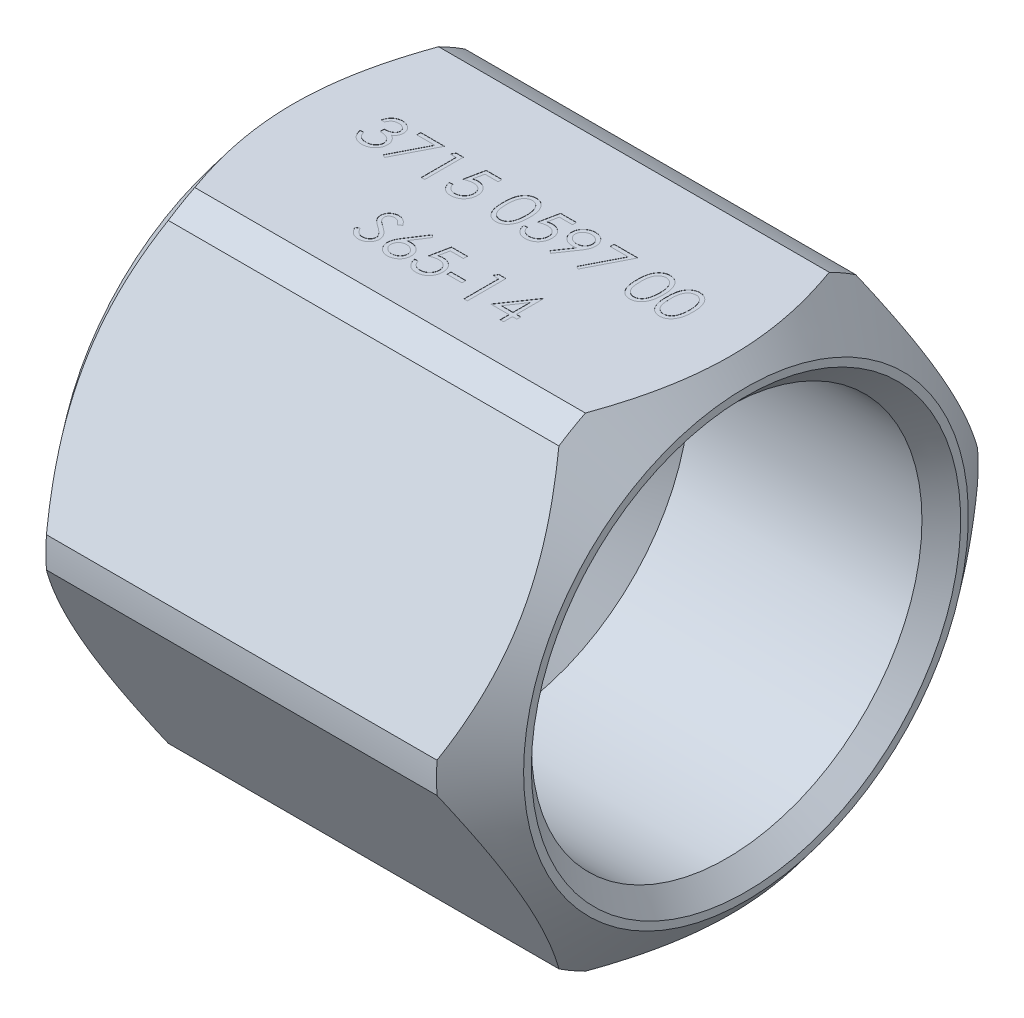
from build123d import *

# Parameters (mm, degrees)
SKETCH2_OUTSIDE_W  = 39.282
SKETCH2_OUTSIDE_H  = 39.282
EXTRUDE1_DEPTH     = 24.2
CHAMFER1_SIZE      = 1
SKETCH3_W          = 0.769230769
SKETCH3_H          = 0.205128205
CUT_EXTRUDE1_DEPTH = 0.01


with BuildPart() as part:
    # Sketch1 → Revolve1 (revolve)
    with BuildSketch(Plane.XY, mode=Mode.PRIVATE) as revolve1_sk:
        Polygon((0, 0), (0, 11.5), (2, 14), (22.2, 14), (24.2, 11.5), (24.2, 10.1), (11.2, 10.1), (7.204303095, 5), (4.2, 0), align=None)
    revolve(revolve1_sk.sketch.rotate(Axis((0, 0, 0), (1, 0, 0)), 90), axis=Axis((0, 0, 0), (1, 0, 0)))

    # Sketch2 outside → Extrude1 (cut)
    with BuildSketch(Plane(origin=(24.2, 0, 0), x_dir=(0, 0, -1), z_dir=(1, 0, 0))):
        Rectangle(SKETCH2_OUTSIDE_W, SKETCH2_OUTSIDE_H)
        Polygon((7.216878365, 12.5), (-7.216878365, 12.5), (-14.43375673, 0), (-7.216878365, -12.5), (7.216878365, -12.5), (14.43375673, 0), align=None, mode=Mode.SUBTRACT)
    extrude(amount=-EXTRUDE1_DEPTH, mode=Mode.SUBTRACT)

    # Chamfer1
    chamfer1_edges = [part.edges().sort_by_distance(p)[0] for p in [
        (24.2, 0, -10.1),
    ]]
    chamfer(chamfer1_edges, length=CHAMFER1_SIZE)

    # Sketch3 → Cut-Extrude1 (cut)
    # profile 1 of 16: a face of its own
    with BuildSketch(Plane(origin=(0, 12.5, 0), x_dir=(1, 0, 0), z_dir=(0, 1, 0))):
        with BuildLine():
            Line((3.971794872, 1.538461538), (3.792307692, 1.538461538))
            add(Edge.make_bspline(
                [(3.792307692, 1.538461538), (3.797170293, 1.558594386), (3.806676279, 1.597952458), (3.826503464, 1.654185178), (3.848103038, 1.707398619), (3.874039669, 1.756596375), (3.902330386, 1.802767177), (3.93474337, 1.844863819), (3.969783211, 1.883956942), (4.008540325, 1.918650221), (4.049185274, 1.950066066), (4.092290771, 1.976851813), (4.136989568, 1.999894186), (4.183591358, 2.018877176), (4.232234885, 2.033177475), (4.282480384, 2.043552793), (4.334459527, 2.050290572), (4.369743864, 2.050948151), (4.387660256, 2.051282051)],
                knots=[0, 0, 0, 0, 1.162005537, 2.271625781, 3.343758855, 4.383309926, 5.390229558, 6.379919256, 7.361854164, 8.333198761, 9.295911338, 10.242430842, 11.177959212, 12.116337295, 13.062827104, 14.020064771, 14.994644689, 16, 16, 16, 16], degree=3))
            add(Edge.make_bspline(
                [(4.387660256, 2.051282051), (4.41376468, 2.05049392), (4.465404115, 2.048934848), (4.541268714, 2.034698027), (4.614426896, 2.01216938), (4.684077895, 1.981041536), (4.748774142, 1.942648786), (4.806337677, 1.89695465), (4.855988255, 1.844840764), (4.897642185, 1.787279298), (4.93025647, 1.725761864), (4.954305826, 1.662447489), (4.968946787, 1.597486362), (4.970844248, 1.55362506), (4.971794872, 1.531650641)],
                knots=[0, 0, 0, 0, 1.083050992, 2.142477498, 3.193116406, 4.255571735, 5.30263384, 6.308962982, 7.297363603, 8.282367274, 9.249857812, 10.179914175, 11.08814088, 12, 12, 12, 12], degree=3))
            add(Edge.make_bspline(
                [(4.971794872, 1.531650641), (4.971129963, 1.510503901), (4.969828839, 1.469123013), (4.958781007, 1.408710729), (4.940188857, 1.351772672), (4.914434707, 1.29806915), (4.881096678, 1.24794067), (4.84071228, 1.201274447), (4.792996473, 1.1578635), (4.75683708, 1.132995229), (4.738221154, 1.120192308)],
                knots=[0, 0, 0, 0, 1.024540389, 2.004866551, 2.965041327, 3.920577974, 4.882998113, 5.874504559, 6.905732034, 8, 8, 8, 8], degree=3))
            add(Edge.make_bspline(
                [(4.738221154, 1.120192308), (4.759496442, 1.109919067), (4.801648942, 1.089564805), (4.859106387, 1.04964723), (4.911265173, 1.003557888), (4.940353013, 0.967590658), (4.954967949, 0.949519231)],
                knots=[0, 0, 0, 0, 1.015518401, 2.012035669, 3.001164323, 4, 4, 4, 4], degree=3))
            add(Edge.make_bspline(
                [(4.954967949, 0.949519231), (4.964591573, 0.936343373), (4.983681228, 0.91020742), (5.00724439, 0.868186606), (5.028621027, 0.82570004), (5.045278295, 0.781608951), (5.058177647, 0.736424372), (5.067398237, 0.690068717), (5.073126318, 0.642504133), (5.073946633, 0.610325573), (5.074358974, 0.594150641)],
                knots=[0, 0, 0, 0, 1.025084078, 2.033381695, 3.024893161, 4.013698104, 4.991890475, 5.976764909, 6.982997093, 8, 8, 8, 8], degree=3))
            add(Edge.make_bspline(
                [(5.074358974, 0.594150641), (5.073333538, 0.566145086), (5.071287491, 0.510265771), (5.052999449, 0.427708787), (5.024649025, 0.3470085), (4.984387919, 0.269822877), (4.935320771, 0.197605517), (4.876945157, 0.132990483), (4.809924353, 0.077448424), (4.735178268, 0.031042579), (4.654197051, -0.006053377), (4.567582427, -0.031800487), (4.476582397, -0.048569629), (4.414178226, -0.05036784), (4.382451923, -0.051282051)],
                knots=[0, 0, 0, 0, 0.955779014, 1.907060117, 2.875433937, 3.871313158, 4.872415639, 5.851225146, 6.836215519, 7.83643374, 8.849228613, 9.86973379, 10.916971861, 12, 12, 12, 12], degree=3))
            add(Edge.make_bspline(
                [(4.382451923, -0.051282051), (4.361069466, -0.050785929), (4.31899592, -0.049809727), (4.257142492, -0.043136241), (4.198101521, -0.030947666), (4.14179318, -0.014545777), (4.088167445, 0.006249504), (4.037387956, 0.032145903), (3.989142302, 0.062609618), (3.943885759, 0.09800024), (3.90162372, 0.137589577), (3.863479306, 0.18208044), (3.828816568, 0.230650385), (3.798563631, 0.28386356), (3.771342515, 0.341032278), (3.748953397, 0.402888563), (3.729247358, 0.468879433), (3.720085379, 0.514866713), (3.715384615, 0.538461538)],
                knots=[0, 0, 0, 0, 1.048658725, 2.063410685, 3.046034179, 4.001477787, 4.936774919, 5.862367409, 6.792675028, 7.730719943, 8.675894397, 9.627829632, 10.600096036, 11.597688215, 12.626045268, 13.701542398, 14.82072376, 16, 16, 16, 16], degree=3))
            Line((3.715384615, 0.538461538), (3.894871795, 0.538461538))
            add(Edge.make_bspline(
                [(3.894871795, 0.538461538), (3.899547961, 0.523062102), (3.908643511, 0.493108861), (3.924125968, 0.450000115), (3.94176498, 0.410481228), (3.960687585, 0.374262301), (3.980560983, 0.340986642), (4.002798083, 0.311534146), (4.02575188, 0.284611173), (4.043054368, 0.269442823), (4.051522436, 0.262019231)],
                knots=[0, 0, 0, 0, 1.198163088, 2.33053128, 3.407730985, 4.417276592, 5.372219308, 6.28897303, 7.162600585, 8, 8, 8, 8], degree=3))
            add(Edge.make_bspline(
                [(4.051522436, 0.262019231), (4.06272048, 0.253385897), (4.085082001, 0.236145879), (4.12152099, 0.214144948), (4.159843783, 0.195081505), (4.200880739, 0.180519393), (4.243746322, 0.168189302), (4.289133388, 0.160120434), (4.336641512, 0.154584336), (4.369080234, 0.154095803), (4.385657051, 0.153846154)],
                knots=[0, 0, 0, 0, 0.946170439, 1.889420265, 2.845303464, 3.807233317, 4.801018734, 5.828864929, 6.890507805, 8, 8, 8, 8], degree=3))
            add(Edge.make_bspline(
                [(4.385657051, 0.153846154), (4.404373339, 0.1541981), (4.440971422, 0.154886299), (4.494374199, 0.161215275), (4.545178455, 0.170432654), (4.592820127, 0.184668644), (4.637923274, 0.202257702), (4.679855645, 0.224342505), (4.719167706, 0.250253775), (4.755355937, 0.279704722), (4.787896227, 0.311945577), (4.816547378, 0.345667332), (4.840904327, 0.380727806), (4.860552086, 0.417321018), (4.876066686, 0.455295434), (4.886628515, 0.494757622), (4.893972238, 0.535384632), (4.894570302, 0.563001185), (4.894871795, 0.576923077)],
                knots=[0, 0, 0, 0, 1.217147791, 2.380027433, 3.494444702, 4.572153297, 5.609568379, 6.639424714, 7.649109417, 8.668170816, 9.669597737, 10.625200337, 11.543417969, 12.441394052, 13.322311151, 14.205496177, 15.095365482, 16, 16, 16, 16], degree=3))
            add(Edge.make_bspline(
                [(4.894871795, 0.576923077), (4.893997337, 0.595558128), (4.892252772, 0.632735504), (4.878933584, 0.687431261), (4.857025661, 0.740130353), (4.826355655, 0.789933662), (4.789020953, 0.83609132), (4.745383863, 0.877275024), (4.695082018, 0.911257933), (4.64878495, 0.934737166), (4.60777629, 0.950758352), (4.572681784, 0.96142976), (4.533392296, 0.970466134), (4.490382954, 0.978873147), (4.443329688, 0.986028203), (4.392283723, 0.991994955), (4.337234717, 0.996769264), (4.299125479, 0.998901318), (4.279487179, 1)],
                knots=[0, 0, 0, 0, 1.07054697, 2.135767047, 3.216561865, 4.33974944, 5.486079747, 6.621378074, 7.775625952, 8.963672916, 9.598146892, 10.304877434, 11.070270905, 11.915000392, 12.823868403, 13.805723172, 14.86925407, 16, 16, 16, 16], degree=3))
            Line((4.279487179, 1), (4.279487179, 1.205128205))
            add(Edge.make_bspline(
                [(4.279487179, 1.205128205), (4.304230703, 1.205548093), (4.352697187, 1.20637055), (4.423493932, 1.216317985), (4.491192968, 1.230078344), (4.554293963, 1.251155596), (4.611807514, 1.275635766), (4.661704429, 1.304122743), (4.703285656, 1.335788314), (4.736349125, 1.371121233), (4.76122297, 1.409015546), (4.779409712, 1.448510779), (4.790152755, 1.4899531), (4.791586851, 1.518235767), (4.792307692, 1.532451923)],
                knots=[0, 0, 0, 0, 1.321986639, 2.589447074, 3.816329219, 5.01088745, 6.139805852, 7.153945165, 8.075214402, 8.924034688, 9.728124013, 10.488707548, 11.240355623, 12, 12, 12, 12], degree=3))
            add(Edge.make_bspline(
                [(4.792307692, 1.532451923), (4.792070886, 1.542896349), (4.791599771, 1.563675039), (4.78565847, 1.594032221), (4.776730446, 1.623461333), (4.764456315, 1.651837224), (4.74802763, 1.678963095), (4.728367066, 1.705070209), (4.704956723, 1.730009511), (4.678130754, 1.753255408), (4.649324008, 1.775409258), (4.617752708, 1.79421705), (4.58436878, 1.810299943), (4.549135263, 1.823562516), (4.511937817, 1.833539252), (4.472951212, 1.84070259), (4.432101107, 1.845181249), (4.404231546, 1.845826059), (4.390064103, 1.846153846)],
                knots=[0, 0, 0, 0, 0.884392785, 1.759457502, 2.611959086, 3.489218968, 4.37281399, 5.2945488, 6.255912374, 7.266815255, 8.301784654, 9.332968512, 10.37626691, 11.440494194, 12.520033166, 13.637162961, 14.798855837, 16, 16, 16, 16], degree=3))
            add(Edge.make_bspline(
                [(4.390064103, 1.846153846), (4.367291721, 1.845358782), (4.322811963, 1.843805837), (4.258689153, 1.830204115), (4.199078105, 1.808502353), (4.153513153, 1.782597771), (4.119865968, 1.757026094), (4.095822003, 1.734693302), (4.072210283, 1.709874546), (4.050584182, 1.681041188), (4.028713338, 1.65014588), (4.00880216, 1.615618062), (3.989453764, 1.578358408), (3.977795165, 1.552018045), (3.971794872, 1.538461538)],
                knots=[0, 0, 0, 0, 1.472543308, 2.876219568, 4.221790263, 5.565193594, 6.249813518, 6.953379497, 7.687249741, 8.463570142, 9.283606569, 10.136032583, 11.040678096, 12, 12, 12, 12], degree=3))
        make_face()
    # profile 2 of 16: a face of its own
    with BuildSketch(Plane(origin=(0, 12.5, 0), x_dir=(1, 0, 0), z_dir=(0, 1, 0))):
        Polygon((5.382051282, 2), (6.612820513, 2), (5.561538462, -0.051282051), (5.406490385, 0.034054487), (6.308733974, 1.794871795), (5.382051282, 1.794871795), align=None)
    # profile 3 of 16: a face of its own
    with BuildSketch(Plane(origin=(0, 12.5, 0), x_dir=(1, 0, 0), z_dir=(0, 1, 0))):
        Polygon((7.217387821, 2), (7.587179487, 2), (7.587179487, 0), (7.407692308, 0), (7.407692308, 1.794871795), (7.1, 1.794871795), align=None)
    # profile 4 of 16: a face of its own
    with BuildSketch(Plane(origin=(0, 12.5, 0), x_dir=(1, 0, 0), z_dir=(0, 1, 0))):
        with BuildLine():
            Line((9.587179487, 2), (9.587179487, 1.794871795))
            Line((9.587179487, 1.794871795), (8.907291667, 1.794871795))
            Line((8.907291667, 1.794871795), (8.79911859, 1.268830128))
            add(Edge.make_bspline(
                [(8.79911859, 1.268830128), (8.820293375, 1.274675998), (8.861316173, 1.286001446), (8.921864665, 1.298576172), (8.979345924, 1.306156425), (9.016646135, 1.30719146), (9.034695513, 1.307692308)],
                knots=[0, 0, 0, 0, 1.100273476, 2.13160584, 3.095893838, 4, 4, 4, 4], degree=3))
            add(Edge.make_bspline(
                [(9.034695513, 1.307692308), (9.057029078, 1.307208916), (9.100942448, 1.306258447), (9.165193275, 1.297131676), (9.226526357, 1.28276601), (9.284813426, 1.262697141), (9.340162312, 1.237034436), (9.392063775, 1.204977327), (9.441296869, 1.167529709), (9.486978351, 1.124475417), (9.528420813, 1.077091636), (9.564858521, 1.026144281), (9.595808573, 0.972128474), (9.620700433, 0.914528126), (9.640577195, 0.853980038), (9.653806906, 0.789847134), (9.662616454, 0.722733923), (9.663600675, 0.676845597), (9.664102564, 0.653445513)],
                knots=[0, 0, 0, 0, 1.052922333, 2.070308379, 3.05430497, 4.020497103, 4.973039431, 5.925935799, 6.892292201, 7.88610001, 8.88166317, 9.857072816, 10.836096531, 11.812156883, 12.81219415, 13.836441305, 14.89672472, 16, 16, 16, 16], degree=3))
            add(Edge.make_bspline(
                [(9.664102564, 0.653445513), (9.663722521, 0.637147101), (9.662967571, 0.604770537), (9.659128378, 0.556688136), (9.65173654, 0.50962366), (9.641812127, 0.463570865), (9.628930745, 0.418616938), (9.613337, 0.374633208), (9.594253555, 0.331893433), (9.573321341, 0.289993207), (9.549751925, 0.249879774), (9.523592778, 0.212366068), (9.495955354, 0.176889335), (9.46621742, 0.143830059), (9.434102566, 0.113405478), (9.399999727, 0.085435031), (9.364181031, 0.059445699), (9.326092321, 0.036492445), (9.286582331, 0.015370756), (9.245080492, -0.00195698), (9.202531521, -0.01744871), (9.15832302, -0.029797012), (9.112555127, -0.039472757), (9.065152398, -0.046044529), (9.016363444, -0.050831064), (8.983292008, -0.051130697), (8.966586538, -0.051282051)],
                knots=[0, 0, 0, 0, 1.056347294, 2.098418968, 3.122841568, 4.141288669, 5.149314143, 6.15115421, 7.162517403, 8.180376062, 9.185164535, 10.17417709, 11.141909838, 12.097768115, 13.052685741, 14.0056014, 14.954263652, 15.917497458, 16.885230207, 17.854509472, 18.828990115, 19.81800267, 20.826176721, 21.857883937, 22.917946725, 24, 24, 24, 24], degree=3))
            add(Edge.make_bspline(
                [(8.966586538, -0.051282051), (8.946658435, -0.050887287), (8.907452246, -0.050110634), (8.850011922, -0.041985785), (8.794746433, -0.030349262), (8.742100661, -0.012842822), (8.691602796, 0.009092775), (8.643932672, 0.036816302), (8.597872228, 0.068232932), (8.555293922, 0.10530742), (8.515776142, 0.145830667), (8.480400994, 0.189806462), (8.448896093, 0.236509), (8.421765952, 0.286165088), (8.398624226, 0.338644249), (8.380444233, 0.394143106), (8.365770887, 0.45237168), (8.359563218, 0.4924594), (8.356410256, 0.512820513)],
                knots=[0, 0, 0, 0, 1.0467383, 2.05933395, 3.04377827, 4.011590433, 4.970194871, 5.932262533, 6.905835911, 7.896367577, 8.894135286, 9.877477877, 10.858688626, 11.851381753, 12.8477658, 13.868841284, 14.917554742, 16, 16, 16, 16], degree=3))
            Line((8.356410256, 0.512820513), (8.535897436, 0.512820513))
            add(Edge.make_bspline(
                [(8.535897436, 0.512820513), (8.540313754, 0.493748254), (8.548802164, 0.457090314), (8.56743402, 0.405586691), (8.590214521, 0.359689991), (8.61730272, 0.318793087), (8.649617023, 0.283130803), (8.686490982, 0.251349624), (8.727832538, 0.222678122), (8.773771527, 0.198779398), (8.822236143, 0.178397253), (8.872960263, 0.164824856), (8.924562747, 0.155281489), (8.959464673, 0.154326197), (8.977003205, 0.153846154)],
                knots=[0, 0, 0, 0, 1.136247022, 2.183929868, 3.172523383, 4.106158343, 5.02341133, 5.958108904, 6.928429099, 7.938127109, 8.96079061, 9.975095812, 10.982467395, 12, 12, 12, 12], degree=3))
            add(Edge.make_bspline(
                [(8.977003205, 0.153846154), (8.994122316, 0.15431517), (9.027829986, 0.155238666), (9.077436493, 0.162346673), (9.125329564, 0.173293857), (9.171036625, 0.189676631), (9.215357504, 0.209587898), (9.257171088, 0.23513937), (9.297687017, 0.264545095), (9.335645951, 0.298234598), (9.37041135, 0.335360138), (9.401129134, 0.375061506), (9.426715942, 0.417413989), (9.448278289, 0.461684362), (9.464651603, 0.508357824), (9.476332164, 0.557215638), (9.483191055, 0.608378484), (9.484134586, 0.643275232), (9.484615385, 0.661057692)],
                knots=[0, 0, 0, 0, 1.027316725, 2.022795036, 3.002884548, 3.971462791, 4.93288096, 5.914575861, 6.907176829, 7.935150275, 8.956128384, 9.956726525, 10.942570165, 11.921478529, 12.907843606, 13.90538589, 14.932640048, 16, 16, 16, 16], degree=3))
            add(Edge.make_bspline(
                [(9.484615385, 0.661057692), (9.484239111, 0.677100979), (9.483502608, 0.70850343), (9.477485139, 0.754445834), (9.467018298, 0.797916143), (9.452490366, 0.839124277), (9.434044933, 0.878109101), (9.411504183, 0.91491085), (9.384445099, 0.949044469), (9.353535448, 0.980525928), (9.319673711, 1.009580142), (9.282277286, 1.034348192), (9.242128757, 1.055184716), (9.199711843, 1.07316643), (9.154017615, 1.086081141), (9.105950968, 1.095777076), (9.054992849, 1.101385854), (9.020152456, 1.102164076), (9.00224359, 1.102564103)],
                knots=[0, 0, 0, 0, 1.045622112, 2.046656509, 3.013763289, 3.955457236, 4.890082067, 5.820317437, 6.762574623, 7.722996705, 8.69280354, 9.665887285, 10.63943826, 11.638615906, 12.663482002, 13.728887084, 14.832589034, 16, 16, 16, 16], degree=3))
            add(Edge.make_bspline(
                [(9.00224359, 1.102564103), (8.986741345, 1.102232336), (8.954733142, 1.101547323), (8.905634384, 1.09650361), (8.854039113, 1.088366871), (8.800145116, 1.077174729), (8.74379054, 1.0625284), (8.685094311, 1.044977256), (8.623933016, 1.023993257), (8.582722887, 1.008146278), (8.561538462, 1)],
                knots=[0, 0, 0, 0, 0.817624296, 1.688186739, 2.600797293, 3.572016777, 4.590301741, 5.671205678, 6.80286297, 8, 8, 8, 8], degree=3))
            Line((8.561538462, 1), (8.766666667, 2))
            Line((8.766666667, 2), (9.587179487, 2))
        make_face()
    # profile 5 of 16: a face of its own
    with BuildSketch(Plane(origin=(0, 12.5, 0), x_dir=(1, 0, 0), z_dir=(0, 1, 0))):
        with BuildLine():
            add(Edge.make_bspline(
                [(10.638461538, 0.999198718), (10.638648977, 1.031254368), (10.63901308, 1.093522931), (10.643063607, 1.184257012), (10.649792374, 1.269377177), (10.659013729, 1.3488875), (10.670235432, 1.422808509), (10.685215711, 1.490942656), (10.702251598, 1.553605288), (10.721995852, 1.611000744), (10.744274589, 1.663902289), (10.768522738, 1.713288118), (10.795702621, 1.759083508), (10.824260857, 1.802019388), (10.855353469, 1.841392928), (10.888095635, 1.877760164), (10.923765278, 1.910280593), (10.961149855, 1.939907051), (11.000587834, 1.965878178), (11.040955072, 1.988754028), (11.082529418, 2.00829681), (11.12542438, 2.023662773), (11.169254413, 2.036354686), (11.214172737, 2.045034084), (11.260253516, 2.050495175), (11.291357193, 2.051017271), (11.30713141, 2.051282051)],
                knots=[0, 0, 0, 0, 1.646270934, 3.197905019, 4.663502075, 6.030701355, 7.308322542, 8.50163776, 9.611534131, 10.641858119, 11.616356847, 12.558055219, 13.465016945, 14.349605745, 15.204443733, 16.039544428, 16.859896111, 17.680448484, 18.487036065, 19.28249412, 20.06191084, 20.843045899, 21.620316918, 22.403196591, 23.190181807, 24, 24, 24, 24], degree=3))
            add(Edge.make_bspline(
                [(11.30713141, 2.051282051), (11.323037398, 2.0510033), (11.354669403, 2.050448951), (11.401435332, 2.045120984), (11.447120864, 2.036280342), (11.491531229, 2.023754071), (11.535031221, 2.008213684), (11.577280597, 1.988735331), (11.618541787, 1.966061693), (11.658159094, 1.939419477), (11.696567445, 1.909715319), (11.732823424, 1.876136651), (11.766930331, 1.839022526), (11.799316219, 1.798770032), (11.829062275, 1.754607127), (11.85738995, 1.707301921), (11.8827454, 1.656027141), (11.907165214, 1.601638303), (11.928243492, 1.542630498), (11.947252775, 1.479336349), (11.962612186, 1.411008242), (11.975406056, 1.338004673), (11.985317425, 1.26005754), (11.992536077, 1.177333931), (11.996349269, 1.089779422), (11.997067384, 1.029917794), (11.997435897, 0.999198718)],
                knots=[0, 0, 0, 0, 0.810914788, 1.612654377, 2.396697861, 3.181598691, 3.963628158, 4.749916497, 5.551656086, 6.361998678, 7.18212741, 8.025565596, 8.878627764, 9.750805457, 10.657531673, 11.591944965, 12.560506719, 13.57287815, 14.630710178, 15.753379473, 16.941251878, 18.199788006, 19.531962791, 20.947069417, 22.433333509, 24, 24, 24, 24], degree=3))
            add(Edge.make_bspline(
                [(11.997435897, 0.999198718), (11.997063563, 0.968613628), (11.996338086, 0.909019827), (11.992578825, 0.821859269), (11.985173893, 0.739574673), (11.975911042, 0.661968695), (11.96308192, 0.589364341), (11.94730754, 0.52151037), (11.92979307, 0.458113758), (11.908173187, 0.399693866), (11.884509924, 0.345435738), (11.858764098, 0.294768796), (11.83118134, 0.247245201), (11.801130629, 0.203245345), (11.769100107, 0.162457541), (11.734404227, 0.125601757), (11.698021036, 0.091789944), (11.659499655, 0.0617033), (11.619264483, 0.035369126), (11.578145011, 0.011818354), (11.535411649, -0.007171757), (11.492032819, -0.023477495), (11.447388038, -0.035934896), (11.401532958, -0.044548528), (11.354700823, -0.050589584), (11.323042786, -0.05105043), (11.30713141, -0.051282051)],
                knots=[0, 0, 0, 0, 1.561518951, 3.042555995, 4.452378317, 5.7783523, 7.031515105, 8.214008947, 9.334062868, 10.386615937, 11.391082383, 12.354592575, 13.286541444, 14.194233754, 15.072674879, 15.931287219, 16.775624067, 17.606195743, 18.42308326, 19.229000347, 20.022332153, 20.807536673, 21.593273796, 22.3848459, 23.188221202, 24, 24, 24, 24], degree=3))
            add(Edge.make_bspline(
                [(11.30713141, -0.051282051), (11.291357631, -0.051015562), (11.260254817, -0.050490098), (11.214167716, -0.04505368), (11.169434892, -0.036313393), (11.125835604, -0.024075333), (11.083146166, -0.009095427), (11.041948288, 0.010420964), (11.001783898, 0.032897574), (10.962760151, 0.058494958), (10.925610345, 0.087821634), (10.890125428, 0.120258371), (10.857196845, 0.156614606), (10.826548791, 0.196316276), (10.79742074, 0.238998129), (10.770626813, 0.285242913), (10.745843468, 0.334867262), (10.723190044, 0.388191783), (10.703105094, 0.445994599), (10.685363546, 0.508936986), (10.671355456, 0.577574493), (10.659365196, 0.651355845), (10.64969412, 0.730598091), (10.643091648, 0.81534425), (10.639010897, 0.905541512), (10.638648, 0.967409955), (10.638461538, 0.999198718)],
                knots=[0, 0, 0, 0, 0.810891512, 1.598919785, 2.382837074, 3.152667961, 3.926044502, 4.706494248, 5.493654104, 6.291793342, 7.103789334, 7.925228297, 8.761435821, 9.622817696, 10.50288917, 11.416980706, 12.369136599, 13.353924996, 14.394355917, 15.514179734, 16.714354668, 17.994756427, 19.357759367, 20.818452758, 22.365282078, 24, 24, 24, 24], degree=3))
        make_face()
        with BuildLine():
            add(Edge.make_bspline(
                [(10.817948718, 1), (10.818016973, 0.973286458), (10.818149444, 0.921440718), (10.82161013, 0.846101712), (10.826324548, 0.775832952), (10.832405289, 0.710545217), (10.841435546, 0.650459496), (10.85155371, 0.595162534), (10.863866904, 0.54494697), (10.878435486, 0.499468221), (10.895029256, 0.457954468), (10.913146892, 0.419325202), (10.932610162, 0.383124095), (10.954392534, 0.349676319), (10.978115427, 0.318872797), (11.003243004, 0.290168321), (11.030713052, 0.264570046), (11.068715191, 0.233868986), (11.118884605, 0.202143767), (11.182096293, 0.17451743), (11.247049694, 0.157156026), (11.291136122, 0.154948165), (11.313141026, 0.153846154)],
                knots=[0, 0, 0, 0, 1.459021318, 2.831673884, 4.118529203, 5.306027144, 6.411944654, 7.436330062, 8.375795394, 9.233974572, 10.042671642, 10.816086306, 11.563610507, 12.285937304, 12.993564865, 13.685989202, 14.367179055, 15.041617293, 16.353048772, 17.594441528, 18.799311195, 20, 20, 20, 20], degree=3))
            add(Edge.make_bspline(
                [(11.313141026, 0.153846154), (11.335288267, 0.154759171), (11.379537023, 0.156583322), (11.444184906, 0.1741826), (11.50694506, 0.200736623), (11.556129026, 0.232135197), (11.593547622, 0.2620371), (11.620357331, 0.287531184), (11.644964216, 0.316077394), (11.668302544, 0.346876992), (11.68970773, 0.380518412), (11.70917238, 0.416839883), (11.726934293, 0.455942271), (11.737053748, 0.483239264), (11.742227564, 0.497195513)],
                knots=[0, 0, 0, 0, 1.353760809, 2.704726607, 4.075137775, 5.516104923, 6.260822281, 7.007110065, 7.778089737, 8.566572457, 9.372053459, 10.217411131, 11.088608312, 12, 12, 12, 12], degree=3))
            add(Edge.make_bspline(
                [(11.742227564, 0.497195513), (11.748257146, 0.515041078), (11.760499782, 0.551275229), (11.776277939, 0.60748303), (11.788703881, 0.666456038), (11.799882947, 0.727841819), (11.807513265, 0.792093077), (11.813654873, 0.859011011), (11.817272408, 0.928646075), (11.817720837, 0.975957498), (11.817948718, 1)],
                knots=[0, 0, 0, 0, 0.884706709, 1.796334032, 2.740027952, 3.714592787, 4.726048262, 5.777819803, 6.87074269, 8, 8, 8, 8], degree=3))
            add(Edge.make_bspline(
                [(11.817948718, 1), (11.817634324, 1.024038613), (11.817019303, 1.071063278), (11.814668452, 1.13993081), (11.808597838, 1.205340959), (11.801855485, 1.267575515), (11.791914216, 1.326289974), (11.781195469, 1.381975863), (11.766794776, 1.433943305), (11.751412048, 1.483005923), (11.733806107, 1.528606297), (11.714425688, 1.570957033), (11.69372754, 1.61026259), (11.671246259, 1.646415128), (11.647248726, 1.679576581), (11.621101555, 1.709082063), (11.593841914, 1.735846045), (11.555660665, 1.766396085), (11.505675356, 1.797545625), (11.443477843, 1.826211773), (11.378751761, 1.842673655), (11.334995502, 1.844994619), (11.313141026, 1.846153846)],
                knots=[0, 0, 0, 0, 1.31362396, 2.569729283, 3.763502607, 4.902122613, 5.988968491, 7.01645872, 7.998833611, 8.933434873, 9.825090667, 10.667526885, 11.477055099, 12.250526234, 12.991942729, 13.710640831, 14.402115721, 15.076753259, 16.378508321, 17.609869233, 18.806226677, 20, 20, 20, 20], degree=3))
            add(Edge.make_bspline(
                [(11.313141026, 1.846153846), (11.291020687, 1.844993019), (11.246739713, 1.842669251), (11.181340881, 1.826273107), (11.11865268, 1.797694269), (11.068799552, 1.766292913), (11.030591674, 1.736385307), (11.003687278, 1.71045019), (10.978460894, 1.682080902), (10.955222208, 1.650994093), (10.933456903, 1.617585312), (10.913467753, 1.581591732), (10.895457851, 1.542830953), (10.878838116, 1.501335847), (10.864225094, 1.455861021), (10.852171401, 1.405707311), (10.841035942, 1.35058623), (10.833152931, 1.290175082), (10.82614507, 1.224870995), (10.821641443, 1.154426813), (10.818137867, 1.078961452), (10.818013031, 1.026847648), (10.817948718, 1)],
                knots=[0, 0, 0, 0, 1.207732386, 2.417664972, 3.655092373, 4.956220595, 5.625982001, 6.301752483, 6.994047911, 7.697131622, 8.419323945, 9.170223765, 9.943494443, 10.752040957, 11.610060368, 12.549350801, 13.567764191, 14.679664412, 15.874934091, 17.154273443, 18.533957287, 20, 20, 20, 20], degree=3))
        make_face(mode=Mode.SUBTRACT)
    # profile 6 of 16: a face of its own
    with BuildSketch(Plane(origin=(0, 12.5, 0), x_dir=(1, 0, 0), z_dir=(0, 1, 0))):
        with BuildLine():
            Line((13.433333333, 2), (13.433333333, 1.794871795))
            Line((13.433333333, 1.794871795), (12.753445513, 1.794871795))
            Line((12.753445513, 1.794871795), (12.645272436, 1.268830128))
            add(Edge.make_bspline(
                [(12.645272436, 1.268830128), (12.666447221, 1.274675998), (12.707470019, 1.286001446), (12.768018511, 1.298576172), (12.82549977, 1.306156425), (12.862799982, 1.30719146), (12.880849359, 1.307692308)],
                knots=[0, 0, 0, 0, 1.100273476, 2.13160584, 3.095893838, 4, 4, 4, 4], degree=3))
            add(Edge.make_bspline(
                [(12.880849359, 1.307692308), (12.903182925, 1.307208916), (12.947096294, 1.306258447), (13.011347121, 1.297131676), (13.072680203, 1.28276601), (13.130967272, 1.262697141), (13.186316158, 1.237034436), (13.238217622, 1.204977327), (13.287450715, 1.167529709), (13.333132197, 1.124475417), (13.374574659, 1.077091636), (13.411012367, 1.026144281), (13.441962419, 0.972128474), (13.466854279, 0.914528126), (13.486731041, 0.853980038), (13.499960752, 0.789847134), (13.5087703, 0.722733923), (13.509754521, 0.676845597), (13.51025641, 0.653445513)],
                knots=[0, 0, 0, 0, 1.052922333, 2.070308379, 3.05430497, 4.020497103, 4.973039431, 5.925935799, 6.892292201, 7.88610001, 8.88166317, 9.857072816, 10.836096531, 11.812156883, 12.81219415, 13.836441305, 14.89672472, 16, 16, 16, 16], degree=3))
            add(Edge.make_bspline(
                [(13.51025641, 0.653445513), (13.509876367, 0.637147101), (13.509121417, 0.604770537), (13.505282224, 0.556688136), (13.497890386, 0.50962366), (13.487965973, 0.463570865), (13.475084591, 0.418616938), (13.459490846, 0.374633208), (13.440407402, 0.331893433), (13.419475187, 0.289993207), (13.395905771, 0.249879774), (13.369746624, 0.212366068), (13.342109201, 0.176889335), (13.312371266, 0.143830059), (13.280256412, 0.113405478), (13.246153573, 0.085435031), (13.210334877, 0.059445699), (13.172246167, 0.036492445), (13.132736177, 0.015370756), (13.091234338, -0.00195698), (13.048685367, -0.01744871), (13.004476866, -0.029797012), (12.958708973, -0.039472757), (12.911306245, -0.046044529), (12.86251729, -0.050831064), (12.829445854, -0.051130697), (12.812740385, -0.051282051)],
                knots=[0, 0, 0, 0, 1.056347294, 2.098418968, 3.122841568, 4.141288669, 5.149314143, 6.15115421, 7.162517403, 8.180376062, 9.185164535, 10.17417709, 11.141909838, 12.097768115, 13.052685741, 14.0056014, 14.954263652, 15.917497458, 16.885230207, 17.854509472, 18.828990115, 19.81800267, 20.826176721, 21.857883937, 22.917946725, 24, 24, 24, 24], degree=3))
            add(Edge.make_bspline(
                [(12.812740385, -0.051282051), (12.792812281, -0.050887287), (12.753606092, -0.050110634), (12.696165768, -0.041985785), (12.640900279, -0.030349262), (12.588254507, -0.012842822), (12.537756642, 0.009092775), (12.490086518, 0.036816302), (12.444026074, 0.068232932), (12.401447768, 0.10530742), (12.361929989, 0.145830667), (12.326554841, 0.189806462), (12.29504994, 0.236509), (12.267919799, 0.286165088), (12.244778072, 0.338644249), (12.226598079, 0.394143106), (12.211924733, 0.45237168), (12.205717064, 0.4924594), (12.202564103, 0.512820513)],
                knots=[0, 0, 0, 0, 1.0467383, 2.05933395, 3.04377827, 4.011590433, 4.970194871, 5.932262533, 6.905835911, 7.896367577, 8.894135286, 9.877477877, 10.858688626, 11.851381753, 12.8477658, 13.868841284, 14.917554742, 16, 16, 16, 16], degree=3))
            Line((12.202564103, 0.512820513), (12.382051282, 0.512820513))
            add(Edge.make_bspline(
                [(12.382051282, 0.512820513), (12.386467601, 0.493748254), (12.39495601, 0.457090314), (12.413587866, 0.405586691), (12.436368367, 0.359689991), (12.463456566, 0.318793087), (12.495770869, 0.283130803), (12.532644828, 0.251349624), (12.573986384, 0.222678122), (12.619925373, 0.198779398), (12.668389989, 0.178397253), (12.719114109, 0.164824856), (12.770716593, 0.155281489), (12.805618519, 0.154326197), (12.823157051, 0.153846154)],
                knots=[0, 0, 0, 0, 1.136247022, 2.183929868, 3.172523383, 4.106158343, 5.02341133, 5.958108904, 6.928429099, 7.938127109, 8.96079061, 9.975095812, 10.982467395, 12, 12, 12, 12], degree=3))
            add(Edge.make_bspline(
                [(12.823157051, 0.153846154), (12.840276162, 0.15431517), (12.873983832, 0.155238666), (12.923590339, 0.162346673), (12.97148341, 0.173293857), (13.017190471, 0.189676631), (13.061511351, 0.209587898), (13.103324934, 0.23513937), (13.143840864, 0.264545095), (13.181799797, 0.298234598), (13.216565197, 0.335360138), (13.24728298, 0.375061506), (13.272869788, 0.417413989), (13.294432136, 0.461684362), (13.310805449, 0.508357824), (13.32248601, 0.557215638), (13.329344901, 0.608378484), (13.330288432, 0.643275232), (13.330769231, 0.661057692)],
                knots=[0, 0, 0, 0, 1.027316725, 2.022795036, 3.002884548, 3.971462791, 4.93288096, 5.914575861, 6.907176829, 7.935150275, 8.956128384, 9.956726525, 10.942570165, 11.921478529, 12.907843606, 13.90538589, 14.932640048, 16, 16, 16, 16], degree=3))
            add(Edge.make_bspline(
                [(13.330769231, 0.661057692), (13.330392957, 0.677100979), (13.329656454, 0.70850343), (13.323638985, 0.754445834), (13.313172144, 0.797916143), (13.298644213, 0.839124277), (13.28019878, 0.878109101), (13.25765803, 0.91491085), (13.230598945, 0.949044469), (13.199689294, 0.980525928), (13.165827557, 1.009580142), (13.128431132, 1.034348192), (13.088282603, 1.055184716), (13.045865689, 1.07316643), (13.000171461, 1.086081141), (12.952104814, 1.095777076), (12.901146695, 1.101385854), (12.866306302, 1.102164076), (12.848397436, 1.102564103)],
                knots=[0, 0, 0, 0, 1.045622112, 2.046656509, 3.013763289, 3.955457236, 4.890082067, 5.820317437, 6.762574623, 7.722996705, 8.69280354, 9.665887285, 10.63943826, 11.638615906, 12.663482002, 13.728887084, 14.832589034, 16, 16, 16, 16], degree=3))
            add(Edge.make_bspline(
                [(12.848397436, 1.102564103), (12.832895191, 1.102232336), (12.800886988, 1.101547323), (12.75178823, 1.09650361), (12.700192959, 1.088366871), (12.646298962, 1.077174729), (12.589944386, 1.0625284), (12.531248157, 1.044977256), (12.470086862, 1.023993257), (12.428876733, 1.008146278), (12.407692308, 1)],
                knots=[0, 0, 0, 0, 0.817624296, 1.688186739, 2.600797293, 3.572016777, 4.590301741, 5.671205678, 6.80286297, 8, 8, 8, 8], degree=3))
            Line((12.407692308, 1), (12.612820513, 2))
            Line((12.612820513, 2), (13.433333333, 2))
        make_face()
    # profile 7 of 16: a face of its own
    with BuildSketch(Plane(origin=(0, 12.5, 0), x_dir=(1, 0, 0), z_dir=(0, 1, 0))):
        with BuildLine():
            Line((14.151282051, -0.051282051), (14.007852564, 0.048477564))
            Line((14.007852564, 0.048477564), (14.563942308, 0.861378205))
            add(Edge.make_bspline(
                [(14.563942308, 0.861378205), (14.528461887, 0.857039312), (14.458598962, 0.848495789), (14.388234903, 0.846926272), (14.353605769, 0.846153846)],
                knots=[0, 0, 0, 0, 1.015715272, 2, 2, 2, 2], degree=3))
            add(Edge.make_bspline(
                [(14.353605769, 0.846153846), (14.332610313, 0.846691604), (14.291398069, 0.847747176), (14.230808554, 0.856113924), (14.172588233, 0.868999711), (14.116891459, 0.888227571), (14.063508884, 0.91212369), (14.012557048, 0.94175627), (13.964104539, 0.976617008), (13.918671734, 1.016521574), (13.87735074, 1.060337604), (13.840537427, 1.106712257), (13.809942494, 1.156184241), (13.784527303, 1.207744366), (13.765252758, 1.262133709), (13.751217022, 1.318733367), (13.742575677, 1.377940019), (13.741547622, 1.418240094), (13.741025641, 1.438701923)],
                knots=[0, 0, 0, 0, 1.060718605, 2.082097864, 3.085795603, 4.069760067, 5.054557537, 6.03741023, 7.043284206, 8.066802108, 9.088538119, 10.083643548, 11.053783639, 12.022749082, 12.983451788, 13.964007469, 14.966251758, 16, 16, 16, 16], degree=3))
            add(Edge.make_bspline(
                [(13.741025641, 1.438701923), (13.742016747, 1.46668401), (13.743962086, 1.521607171), (13.759618381, 1.601855039), (13.785367147, 1.677733064), (13.821269076, 1.749041746), (13.866488917, 1.814755312), (13.920836683, 1.873960231), (13.983981805, 1.925814433), (14.054485816, 1.970388192), (14.130687542, 2.006236762), (14.210498204, 2.032659219), (14.293306273, 2.048201361), (14.349402084, 2.050250424), (14.377644231, 2.051282051)],
                knots=[0, 0, 0, 0, 1.022988612, 2.007919123, 2.978103895, 3.94594894, 4.918897164, 5.887013414, 6.875921846, 7.89917871, 8.930658928, 9.948724884, 10.967259574, 12, 12, 12, 12], degree=3))
            add(Edge.make_bspline(
                [(14.377644231, 2.051282051), (14.405351899, 2.050236244), (14.46009964, 2.048169827), (14.540607644, 2.03303613), (14.617716796, 2.00752946), (14.690999646, 1.972281138), (14.758850739, 1.928097762), (14.819865488, 1.875449463), (14.87265151, 1.814303447), (14.917122299, 1.746138596), (14.952819465, 1.672900321), (14.978575055, 1.596452365), (14.994429706, 1.517344524), (14.996427607, 1.463747682), (14.997435897, 1.436698718)],
                knots=[0, 0, 0, 0, 1.026385292, 2.028040595, 3.023318987, 4.028184125, 5.03290303, 6.015178782, 7.004435299, 8.016004309, 9.023023918, 10.015172535, 10.998308025, 12, 12, 12, 12], degree=3))
            add(Edge.make_bspline(
                [(14.997435897, 1.436698718), (14.996762521, 1.41570228), (14.995396745, 1.373116256), (14.985833141, 1.308413203), (14.969593035, 1.242441072), (14.951163493, 1.18660016), (14.933373683, 1.140481046), (14.916630179, 1.104051572), (14.898051806, 1.065707993), (14.87638394, 1.025852371), (14.853091199, 0.983976637), (14.826771612, 0.940500799), (14.798025571, 0.895366518), (14.777551446, 0.86493961), (14.767067308, 0.849358974)],
                knots=[0, 0, 0, 0, 1.179839688, 2.393009684, 3.667231171, 4.993948276, 5.694988576, 6.444077775, 7.246288328, 8.089075292, 8.993003841, 9.939041771, 10.944649915, 12, 12, 12, 12], degree=3))
            Line((14.767067308, 0.849358974), (14.151282051, -0.051282051))
        make_face()
        with BuildLine():
            add(Edge.make_bspline(
                [(14.386858974, 1.051282051), (14.402764125, 1.051716556), (14.433726047, 1.05256239), (14.479084504, 1.057710528), (14.521898334, 1.06683852), (14.562281905, 1.079935498), (14.600640135, 1.095739309), (14.636363751, 1.115860444), (14.669482651, 1.13986995), (14.700218609, 1.166847102), (14.727512324, 1.196818864), (14.751822627, 1.228188639), (14.772485808, 1.26109413), (14.788807681, 1.295947423), (14.802227438, 1.331900114), (14.811494874, 1.369531174), (14.816628778, 1.408644546), (14.817503964, 1.435215207), (14.817948718, 1.448717949)],
                knots=[0, 0, 0, 0, 1.163407946, 2.26475976, 3.333800367, 4.359385343, 5.366239384, 6.363380779, 7.350133999, 8.353570782, 9.349036268, 10.310270964, 11.253520213, 12.184142, 13.120487599, 14.056272588, 15.012232024, 16, 16, 16, 16], degree=3))
            add(Edge.make_bspline(
                [(14.817948718, 1.448717949), (14.81756605, 1.462226329), (14.816811955, 1.488846249), (14.81076207, 1.528017529), (14.800119085, 1.565556535), (14.785838808, 1.601668781), (14.767027244, 1.636057565), (14.744453823, 1.669154634), (14.717635281, 1.700750136), (14.686776671, 1.730100984), (14.653499784, 1.757156926), (14.618036641, 1.781034684), (14.580679546, 1.801046796), (14.541656409, 1.817560493), (14.500885924, 1.830447222), (14.458392216, 1.839714287), (14.413960556, 1.844841004), (14.383799821, 1.845710658), (14.368429487, 1.846153846)],
                knots=[0, 0, 0, 0, 0.972161553, 1.915763587, 2.844109794, 3.775983486, 4.705125789, 5.659731448, 6.655561913, 7.682237399, 8.721216875, 9.739758359, 10.754845918, 11.767244016, 12.7857855, 13.828538656, 14.893392813, 16, 16, 16, 16], degree=3))
            add(Edge.make_bspline(
                [(14.368429487, 1.846153846), (14.353192828, 1.845709942), (14.323298629, 1.844839007), (14.279261966, 1.839724032), (14.237055584, 1.830384898), (14.19640323, 1.817566462), (14.157381252, 1.801045564), (14.120025919, 1.781033635), (14.084554481, 1.757162422), (14.051309498, 1.730079695), (14.0203964, 1.700886755), (13.994038955, 1.669016224), (13.971413873, 1.636074781), (13.952628157, 1.601664205), (13.938341005, 1.565557756), (13.927699861, 1.528017198), (13.921649481, 1.488846335), (13.920895454, 1.462226358), (13.920512821, 1.448717949)],
                knots=[0, 0, 0, 0, 1.099389452, 2.15699305, 3.192601482, 4.213358962, 5.227959689, 6.245255729, 7.266013209, 8.307253147, 9.336162325, 10.327954924, 11.284637477, 12.215801273, 13.149702402, 14.080068371, 15.025723358, 16, 16, 16, 16], degree=3))
            add(Edge.make_bspline(
                [(13.920512821, 1.448717949), (13.920859064, 1.435204692), (13.92154192, 1.408554077), (13.928129228, 1.369396139), (13.939145388, 1.331860028), (13.953899325, 1.295580767), (13.973328805, 1.260911133), (13.997171004, 1.228015498), (14.025117031, 1.196520955), (14.056793309, 1.166916834), (14.09146083, 1.139744162), (14.128487542, 1.116012515), (14.16723602, 1.095971119), (14.207842666, 1.079890328), (14.250006552, 1.066969377), (14.294106627, 1.057727351), (14.339997048, 1.05261177), (14.371088467, 1.051729543), (14.386858974, 1.051282051)],
                knots=[0, 0, 0, 0, 0.952633368, 1.87876736, 2.791047057, 3.707742249, 4.635551637, 5.587206343, 6.568248508, 7.601284464, 8.641511608, 9.671105535, 10.699146789, 11.713763218, 12.747829548, 13.806491675, 14.887386225, 16, 16, 16, 16], degree=3))
        make_face(mode=Mode.SUBTRACT)
    # profile 8 of 16: a face of its own
    with BuildSketch(Plane(origin=(0, 12.5, 0), x_dir=(1, 0, 0), z_dir=(0, 1, 0))):
        Polygon((15.382051282, 2), (16.612820513, 2), (15.561538462, -0.051282051), (15.406490385, 0.034054487), (16.308733974, 1.794871795), (15.382051282, 1.794871795), align=None)
    # profile 9 of 16: a face of its own
    with BuildSketch(Plane(origin=(0, 12.5, 0), x_dir=(1, 0, 0), z_dir=(0, 1, 0))):
        with BuildLine():
            add(Edge.make_bspline(
                [(17.561538462, 0.999198718), (17.5617259, 1.031254368), (17.562090003, 1.093522931), (17.56614053, 1.184257012), (17.572869297, 1.269377177), (17.582090653, 1.3488875), (17.593312356, 1.422808509), (17.608292634, 1.490942656), (17.625328521, 1.553605288), (17.645072776, 1.611000744), (17.667351512, 1.663902289), (17.691599661, 1.713288118), (17.718779544, 1.759083508), (17.74733778, 1.802019388), (17.778430392, 1.841392928), (17.811172558, 1.877760164), (17.846842202, 1.910280593), (17.884226778, 1.939907051), (17.923664757, 1.965878178), (17.964031995, 1.988754028), (18.005606341, 2.00829681), (18.048501303, 2.023662773), (18.092331336, 2.036354686), (18.13724966, 2.045034084), (18.183330439, 2.050495175), (18.214434116, 2.051017271), (18.230208333, 2.051282051)],
                knots=[0, 0, 0, 0, 1.646270934, 3.197905019, 4.663502075, 6.030701355, 7.308322542, 8.50163776, 9.611534131, 10.641858119, 11.616356847, 12.558055219, 13.465016945, 14.349605745, 15.204443733, 16.039544428, 16.859896111, 17.680448484, 18.487036065, 19.28249412, 20.06191084, 20.843045899, 21.620316918, 22.403196591, 23.190181807, 24, 24, 24, 24], degree=3))
            add(Edge.make_bspline(
                [(18.230208333, 2.051282051), (18.246114321, 2.0510033), (18.277746326, 2.050448951), (18.324512255, 2.045120984), (18.370197787, 2.036280342), (18.414608152, 2.023754071), (18.458108144, 2.008213684), (18.50035752, 1.988735331), (18.54161871, 1.966061693), (18.581236017, 1.939419477), (18.619644369, 1.909715319), (18.655900347, 1.876136651), (18.690007254, 1.839022526), (18.722393142, 1.798770032), (18.752139198, 1.754607127), (18.780466874, 1.707301921), (18.805822323, 1.656027141), (18.830242137, 1.601638303), (18.851320415, 1.542630498), (18.870329698, 1.479336349), (18.885689109, 1.411008242), (18.898482979, 1.338004673), (18.908394348, 1.26005754), (18.915613, 1.177333931), (18.919426192, 1.089779422), (18.920144307, 1.029917794), (18.920512821, 0.999198718)],
                knots=[0, 0, 0, 0, 0.810914788, 1.612654377, 2.396697861, 3.181598691, 3.963628158, 4.749916497, 5.551656086, 6.361998678, 7.18212741, 8.025565596, 8.878627764, 9.750805457, 10.657531673, 11.591944965, 12.560506719, 13.57287815, 14.630710178, 15.753379473, 16.941251878, 18.199788006, 19.531962791, 20.947069417, 22.433333509, 24, 24, 24, 24], degree=3))
            add(Edge.make_bspline(
                [(18.920512821, 0.999198718), (18.920140486, 0.968613628), (18.919415009, 0.909019827), (18.915655748, 0.821859269), (18.908250816, 0.739574673), (18.898987965, 0.661968695), (18.886158844, 0.589364341), (18.870384463, 0.52151037), (18.852869993, 0.458113758), (18.83125011, 0.399693866), (18.807586847, 0.345435738), (18.781841021, 0.294768796), (18.754258263, 0.247245201), (18.724207552, 0.203245345), (18.69217703, 0.162457541), (18.657481151, 0.125601757), (18.621097959, 0.091789944), (18.582576579, 0.0617033), (18.542341406, 0.035369126), (18.501221934, 0.011818354), (18.458488572, -0.007171757), (18.415109742, -0.023477495), (18.370464961, -0.035934896), (18.324609881, -0.044548528), (18.277777746, -0.050589584), (18.246119709, -0.05105043), (18.230208333, -0.051282051)],
                knots=[0, 0, 0, 0, 1.561518951, 3.042555995, 4.452378317, 5.7783523, 7.031515105, 8.214008947, 9.334062868, 10.386615937, 11.391082383, 12.354592575, 13.286541444, 14.194233754, 15.072674879, 15.931287219, 16.775624067, 17.606195743, 18.42308326, 19.229000347, 20.022332153, 20.807536673, 21.593273796, 22.3848459, 23.188221202, 24, 24, 24, 24], degree=3))
            add(Edge.make_bspline(
                [(18.230208333, -0.051282051), (18.214434554, -0.051015562), (18.18333174, -0.050490098), (18.13724464, -0.04505368), (18.092511815, -0.036313393), (18.048912527, -0.024075333), (18.006223089, -0.009095427), (17.965025211, 0.010420964), (17.924860821, 0.032897574), (17.885837074, 0.058494958), (17.848687268, 0.087821634), (17.813202351, 0.120258371), (17.780273768, 0.156614606), (17.749625714, 0.196316276), (17.720497663, 0.238998129), (17.693703736, 0.285242913), (17.668920391, 0.334867262), (17.646266967, 0.388191783), (17.626182017, 0.445994599), (17.608440469, 0.508936986), (17.594432379, 0.577574493), (17.582442119, 0.651355845), (17.572771043, 0.730598091), (17.566168571, 0.81534425), (17.56208782, 0.905541512), (17.561724923, 0.967409955), (17.561538462, 0.999198718)],
                knots=[0, 0, 0, 0, 0.810891512, 1.598919785, 2.382837074, 3.152667961, 3.926044502, 4.706494248, 5.493654104, 6.291793342, 7.103789334, 7.925228297, 8.761435821, 9.622817696, 10.50288917, 11.416980706, 12.369136599, 13.353924996, 14.394355917, 15.514179734, 16.714354668, 17.994756427, 19.357759367, 20.818452758, 22.365282078, 24, 24, 24, 24], degree=3))
        make_face()
        with BuildLine():
            add(Edge.make_bspline(
                [(17.741025641, 1), (17.741093896, 0.973286458), (17.741226367, 0.921440718), (17.744687053, 0.846101712), (17.749401471, 0.775832952), (17.755482213, 0.710545217), (17.764512469, 0.650459496), (17.774630633, 0.595162534), (17.786943827, 0.54494697), (17.801512409, 0.499468221), (17.818106179, 0.457954468), (17.836223815, 0.419325202), (17.855687085, 0.383124095), (17.877469457, 0.349676319), (17.90119235, 0.318872797), (17.926319927, 0.290168321), (17.953789975, 0.264570046), (17.991792114, 0.233868986), (18.041961528, 0.202143767), (18.105173216, 0.17451743), (18.170126617, 0.157156026), (18.214213046, 0.154948165), (18.236217949, 0.153846154)],
                knots=[0, 0, 0, 0, 1.459021318, 2.831673884, 4.118529203, 5.306027144, 6.411944654, 7.436330062, 8.375795394, 9.233974572, 10.042671642, 10.816086306, 11.563610507, 12.285937304, 12.993564865, 13.685989202, 14.367179055, 15.041617293, 16.353048772, 17.594441528, 18.799311195, 20, 20, 20, 20], degree=3))
            add(Edge.make_bspline(
                [(18.236217949, 0.153846154), (18.25836519, 0.154759171), (18.302613946, 0.156583322), (18.367261829, 0.1741826), (18.430021983, 0.200736623), (18.479205949, 0.232135197), (18.516624545, 0.2620371), (18.543434254, 0.287531184), (18.568041139, 0.316077394), (18.591379467, 0.346876992), (18.612784653, 0.380518412), (18.632249303, 0.416839883), (18.650011216, 0.455942271), (18.660130671, 0.483239264), (18.665304487, 0.497195513)],
                knots=[0, 0, 0, 0, 1.353760809, 2.704726607, 4.075137775, 5.516104923, 6.260822281, 7.007110065, 7.778089737, 8.566572457, 9.372053459, 10.217411131, 11.088608312, 12, 12, 12, 12], degree=3))
            add(Edge.make_bspline(
                [(18.665304487, 0.497195513), (18.671334069, 0.515041078), (18.683576705, 0.551275229), (18.699354862, 0.60748303), (18.711780804, 0.666456038), (18.722959871, 0.727841819), (18.730590188, 0.792093077), (18.736731796, 0.859011011), (18.740349331, 0.928646075), (18.74079776, 0.975957498), (18.741025641, 1)],
                knots=[0, 0, 0, 0, 0.884706709, 1.796334032, 2.740027952, 3.714592787, 4.726048262, 5.777819803, 6.87074269, 8, 8, 8, 8], degree=3))
            add(Edge.make_bspline(
                [(18.741025641, 1), (18.740711247, 1.024038613), (18.740096226, 1.071063278), (18.737745375, 1.13993081), (18.731674761, 1.205340959), (18.724932408, 1.267575515), (18.714991139, 1.326289974), (18.704272392, 1.381975863), (18.689871699, 1.433943305), (18.674488971, 1.483005923), (18.65688303, 1.528606297), (18.637502611, 1.570957033), (18.616804463, 1.61026259), (18.594323183, 1.646415128), (18.570325649, 1.679576581), (18.544178478, 1.709082063), (18.516918837, 1.735846045), (18.478737588, 1.766396085), (18.428752279, 1.797545625), (18.366554767, 1.826211773), (18.301828684, 1.842673655), (18.258072425, 1.844994619), (18.236217949, 1.846153846)],
                knots=[0, 0, 0, 0, 1.31362396, 2.569729283, 3.763502607, 4.902122613, 5.988968491, 7.01645872, 7.998833611, 8.933434873, 9.825090667, 10.667526885, 11.477055099, 12.250526234, 12.991942729, 13.710640831, 14.402115721, 15.076753259, 16.378508321, 17.609869233, 18.806226677, 20, 20, 20, 20], degree=3))
            add(Edge.make_bspline(
                [(18.236217949, 1.846153846), (18.21409761, 1.844993019), (18.169816636, 1.842669251), (18.104417804, 1.826273107), (18.041729604, 1.797694269), (17.991876475, 1.766292913), (17.953668597, 1.736385307), (17.926764201, 1.71045019), (17.901537817, 1.682080902), (17.878299131, 1.650994093), (17.856533826, 1.617585312), (17.836544676, 1.581591732), (17.818534774, 1.542830953), (17.801915039, 1.501335847), (17.787302017, 1.455861021), (17.775248324, 1.405707311), (17.764112865, 1.35058623), (17.756229854, 1.290175082), (17.749221993, 1.224870995), (17.744718366, 1.154426813), (17.74121479, 1.078961452), (17.741089954, 1.026847648), (17.741025641, 1)],
                knots=[0, 0, 0, 0, 1.207732386, 2.417664972, 3.655092373, 4.956220595, 5.625982001, 6.301752483, 6.994047911, 7.697131622, 8.419323945, 9.170223765, 9.943494443, 10.752040957, 11.610060368, 12.549350801, 13.567764191, 14.679664412, 15.874934091, 17.154273443, 18.533957287, 20, 20, 20, 20], degree=3))
        make_face(mode=Mode.SUBTRACT)
    # profile 10 of 16: a face of its own
    with BuildSketch(Plane(origin=(0, 12.5, 0), x_dir=(1, 0, 0), z_dir=(0, 1, 0))):
        with BuildLine():
            add(Edge.make_bspline(
                [(19.1, 0.999198718), (19.100187439, 1.031254368), (19.100551542, 1.093522931), (19.104602068, 1.184257012), (19.111330835, 1.269377177), (19.120552191, 1.3488875), (19.131773894, 1.422808509), (19.146754172, 1.490942656), (19.163790059, 1.553605288), (19.183534314, 1.611000744), (19.205813051, 1.663902289), (19.2300612, 1.713288118), (19.257241082, 1.759083508), (19.285799318, 1.802019388), (19.31689193, 1.841392928), (19.349634096, 1.877760164), (19.38530374, 1.910280593), (19.422688316, 1.939907051), (19.462126296, 1.965878178), (19.502493534, 1.988754028), (19.54406788, 2.00829681), (19.586962841, 2.023662773), (19.630792875, 2.036354686), (19.675711198, 2.045034084), (19.721791978, 2.050495175), (19.752895655, 2.051017271), (19.768669872, 2.051282051)],
                knots=[0, 0, 0, 0, 1.646270934, 3.197905019, 4.663502075, 6.030701355, 7.308322542, 8.50163776, 9.611534131, 10.641858119, 11.616356847, 12.558055219, 13.465016945, 14.349605745, 15.204443733, 16.039544428, 16.859896111, 17.680448484, 18.487036065, 19.28249412, 20.06191084, 20.843045899, 21.620316918, 22.403196591, 23.190181807, 24, 24, 24, 24], degree=3))
            add(Edge.make_bspline(
                [(19.768669872, 2.051282051), (19.78457586, 2.0510033), (19.816207865, 2.050448951), (19.862973793, 2.045120984), (19.908659326, 2.036280342), (19.953069691, 2.023754071), (19.996569683, 2.008213684), (20.038819059, 1.988735331), (20.080080248, 1.966061693), (20.119697555, 1.939419477), (20.158105907, 1.909715319), (20.194361886, 1.876136651), (20.228468792, 1.839022526), (20.260854681, 1.798770032), (20.290600736, 1.754607127), (20.318928412, 1.707301921), (20.344283861, 1.656027141), (20.368703675, 1.601638303), (20.389781954, 1.542630498), (20.408791237, 1.479336349), (20.424150647, 1.411008242), (20.436944517, 1.338004673), (20.446855886, 1.26005754), (20.454074539, 1.177333931), (20.45788773, 1.089779422), (20.458605845, 1.029917794), (20.458974359, 0.999198718)],
                knots=[0, 0, 0, 0, 0.810914788, 1.612654377, 2.396697861, 3.181598691, 3.963628158, 4.749916497, 5.551656086, 6.361998678, 7.18212741, 8.025565596, 8.878627764, 9.750805457, 10.657531673, 11.591944965, 12.560506719, 13.57287815, 14.630710178, 15.753379473, 16.941251878, 18.199788006, 19.531962791, 20.947069417, 22.433333509, 24, 24, 24, 24], degree=3))
            add(Edge.make_bspline(
                [(20.458974359, 0.999198718), (20.458602025, 0.968613628), (20.457876547, 0.909019827), (20.454117286, 0.821859269), (20.446712354, 0.739574673), (20.437449504, 0.661968695), (20.424620382, 0.589364341), (20.408846001, 0.52151037), (20.391331531, 0.458113758), (20.369711649, 0.399693866), (20.346048386, 0.345435738), (20.320302559, 0.294768796), (20.292719802, 0.247245201), (20.26266909, 0.203245345), (20.230638568, 0.162457541), (20.195942689, 0.125601757), (20.159559498, 0.091789944), (20.121038117, 0.0617033), (20.080802945, 0.035369126), (20.039683472, 0.011818354), (19.99695011, -0.007171757), (19.95357128, -0.023477495), (19.9089265, -0.035934896), (19.863071419, -0.044548528), (19.816239284, -0.050589584), (19.784581247, -0.05105043), (19.768669872, -0.051282051)],
                knots=[0, 0, 0, 0, 1.561518951, 3.042555995, 4.452378317, 5.7783523, 7.031515105, 8.214008947, 9.334062868, 10.386615937, 11.391082383, 12.354592575, 13.286541444, 14.194233754, 15.072674879, 15.931287219, 16.775624067, 17.606195743, 18.42308326, 19.229000347, 20.022332153, 20.807536673, 21.593273796, 22.3848459, 23.188221202, 24, 24, 24, 24], degree=3))
            add(Edge.make_bspline(
                [(19.768669872, -0.051282051), (19.752896092, -0.051015562), (19.721793278, -0.050490098), (19.675706178, -0.04505368), (19.630973353, -0.036313393), (19.587374065, -0.024075333), (19.544684628, -0.009095427), (19.50348675, 0.010420964), (19.463322359, 0.032897574), (19.424298613, 0.058494958), (19.387148807, 0.087821634), (19.351663889, 0.120258371), (19.318735307, 0.156614606), (19.288087252, 0.196316276), (19.258959202, 0.238998129), (19.232165274, 0.285242913), (19.207381929, 0.334867262), (19.184728506, 0.388191783), (19.164643555, 0.445994599), (19.146902008, 0.508936986), (19.132893918, 0.577574493), (19.120903658, 0.651355845), (19.111232582, 0.730598091), (19.10463011, 0.81534425), (19.100549359, 0.905541512), (19.100186461, 0.967409955), (19.1, 0.999198718)],
                knots=[0, 0, 0, 0, 0.810891512, 1.598919785, 2.382837074, 3.152667961, 3.926044502, 4.706494248, 5.493654104, 6.291793342, 7.103789334, 7.925228297, 8.761435821, 9.622817696, 10.50288917, 11.416980706, 12.369136599, 13.353924996, 14.394355917, 15.514179734, 16.714354668, 17.994756427, 19.357759367, 20.818452758, 22.365282078, 24, 24, 24, 24], degree=3))
        make_face()
        with BuildLine():
            add(Edge.make_bspline(
                [(19.279487179, 1), (19.279555435, 0.973286458), (19.279687905, 0.921440718), (19.283148591, 0.846101712), (19.28786301, 0.775832952), (19.293943751, 0.710545217), (19.302974007, 0.650459496), (19.313092172, 0.595162534), (19.325405366, 0.54494697), (19.339973947, 0.499468221), (19.356567717, 0.457954468), (19.374685354, 0.419325202), (19.394148624, 0.383124095), (19.415930995, 0.349676319), (19.439653889, 0.318872797), (19.464781465, 0.290168321), (19.492251514, 0.264570046), (19.530253652, 0.233868986), (19.580423066, 0.202143767), (19.643634755, 0.17451743), (19.708588155, 0.157156026), (19.752674584, 0.154948165), (19.774679487, 0.153846154)],
                knots=[0, 0, 0, 0, 1.459021318, 2.831673884, 4.118529203, 5.306027144, 6.411944654, 7.436330062, 8.375795394, 9.233974572, 10.042671642, 10.816086306, 11.563610507, 12.285937304, 12.993564865, 13.685989202, 14.367179055, 15.041617293, 16.353048772, 17.594441528, 18.799311195, 20, 20, 20, 20], degree=3))
            add(Edge.make_bspline(
                [(19.774679487, 0.153846154), (19.796826728, 0.154759171), (19.841075484, 0.156583322), (19.905723367, 0.1741826), (19.968483522, 0.200736623), (20.017667487, 0.232135197), (20.055086084, 0.2620371), (20.081895792, 0.287531184), (20.106502677, 0.316077394), (20.129841006, 0.346876992), (20.151246192, 0.380518412), (20.170710842, 0.416839883), (20.188472755, 0.455942271), (20.19859221, 0.483239264), (20.203766026, 0.497195513)],
                knots=[0, 0, 0, 0, 1.353760809, 2.704726607, 4.075137775, 5.516104923, 6.260822281, 7.007110065, 7.778089737, 8.566572457, 9.372053459, 10.217411131, 11.088608312, 12, 12, 12, 12], degree=3))
            add(Edge.make_bspline(
                [(20.203766026, 0.497195513), (20.209795607, 0.515041078), (20.222038244, 0.551275229), (20.2378164, 0.60748303), (20.250242343, 0.666456038), (20.261421409, 0.727841819), (20.269051727, 0.792093077), (20.275193334, 0.859011011), (20.27881087, 0.928646075), (20.279259299, 0.975957498), (20.279487179, 1)],
                knots=[0, 0, 0, 0, 0.884706709, 1.796334032, 2.740027952, 3.714592787, 4.726048262, 5.777819803, 6.87074269, 8, 8, 8, 8], degree=3))
            add(Edge.make_bspline(
                [(20.279487179, 1), (20.279172786, 1.024038613), (20.278557764, 1.071063278), (20.276206914, 1.13993081), (20.2701363, 1.205340959), (20.263393946, 1.267575515), (20.253452677, 1.326289974), (20.24273393, 1.381975863), (20.228333238, 1.433943305), (20.212950509, 1.483005923), (20.195344569, 1.528606297), (20.175964149, 1.570957033), (20.155266001, 1.61026259), (20.132784721, 1.646415128), (20.108787188, 1.679576581), (20.082640017, 1.709082063), (20.055380375, 1.735846045), (20.017199126, 1.766396085), (19.967213818, 1.797545625), (19.905016305, 1.826211773), (19.840290223, 1.842673655), (19.796533963, 1.844994619), (19.774679487, 1.846153846)],
                knots=[0, 0, 0, 0, 1.31362396, 2.569729283, 3.763502607, 4.902122613, 5.988968491, 7.01645872, 7.998833611, 8.933434873, 9.825090667, 10.667526885, 11.477055099, 12.250526234, 12.991942729, 13.710640831, 14.402115721, 15.076753259, 16.378508321, 17.609869233, 18.806226677, 20, 20, 20, 20], degree=3))
            add(Edge.make_bspline(
                [(19.774679487, 1.846153846), (19.752559149, 1.844993019), (19.708278174, 1.842669251), (19.642879343, 1.826273107), (19.580191142, 1.797694269), (19.530338014, 1.766292913), (19.492130136, 1.736385307), (19.465225739, 1.71045019), (19.439999355, 1.682080902), (19.416760669, 1.650994093), (19.394995365, 1.617585312), (19.375006215, 1.581591732), (19.356996312, 1.542830953), (19.340376577, 1.501335847), (19.325763555, 1.455861021), (19.313709862, 1.405707311), (19.302574403, 1.35058623), (19.294691392, 1.290175082), (19.287683532, 1.224870995), (19.283179905, 1.154426813), (19.279676329, 1.078961452), (19.279551492, 1.026847648), (19.279487179, 1)],
                knots=[0, 0, 0, 0, 1.207732386, 2.417664972, 3.655092373, 4.956220595, 5.625982001, 6.301752483, 6.994047911, 7.697131622, 8.419323945, 9.170223765, 9.943494443, 10.752040957, 11.610060368, 12.549350801, 13.567764191, 14.679664412, 15.874934091, 17.154273443, 18.533957287, 20, 20, 20, 20], degree=3))
        make_face(mode=Mode.SUBTRACT)
    # profile 11 of 16: a face of its own
    with BuildSketch(Plane(origin=(0, 12.5, 0), x_dir=(1, 0, 0), z_dir=(0, 1, 0))):
        with BuildLine():
            Line((7.920512821, -3.947516026), (8.089583333, -3.846153846))
            add(Edge.make_bspline(
                [(8.089583333, -3.846153846), (8.10530804, -3.872476352), (8.135435972, -3.922909257), (8.185693892, -3.991056709), (8.237769841, -4.048977941), (8.29204946, -4.096336002), (8.34820143, -4.133621081), (8.406592318, -4.160022356), (8.467025353, -4.176488628), (8.508153251, -4.178488677), (8.528685897, -4.179487179)],
                knots=[0, 0, 0, 0, 1.272034388, 2.437168799, 3.508375237, 4.49857839, 5.41946034, 6.295179144, 7.148887113, 8, 8, 8, 8], degree=3))
            add(Edge.make_bspline(
                [(8.528685897, -4.179487179), (8.546221246, -4.178998795), (8.580985117, -4.178030572), (8.632163541, -4.168727257), (8.681867428, -4.154434612), (8.729072364, -4.133965508), (8.773127001, -4.109200659), (8.811759398, -4.079288557), (8.845157177, -4.045799297), (8.872476671, -4.00843778), (8.893436691, -3.968256552), (8.909546445, -3.927013152), (8.918486487, -3.884059684), (8.919833203, -3.85513942), (8.920512821, -3.840544872)],
                knots=[0, 0, 0, 0, 1.095163259, 2.171163733, 3.241058638, 4.321873601, 5.38011039, 6.391990106, 7.366004449, 8.327778327, 9.272591725, 10.192022065, 11.087607919, 12, 12, 12, 12], degree=3))
            add(Edge.make_bspline(
                [(8.920512821, -3.840544872), (8.919670357, -3.823892958), (8.917957753, -3.79004205), (8.903482621, -3.740099391), (8.880711623, -3.690675065), (8.859704398, -3.660102913), (8.848798077, -3.644230769)],
                knots=[0, 0, 0, 0, 0.938893495, 1.908633276, 2.914225137, 4, 4, 4, 4], degree=3))
            add(Edge.make_bspline(
                [(8.848798077, -3.644230769), (8.83984344, -3.632775441), (8.821044301, -3.608726414), (8.788725722, -3.572929136), (8.750802228, -3.536004325), (8.708571625, -3.496542007), (8.660495575, -3.456377552), (8.608079852, -3.413595679), (8.549986218, -3.369823349), (8.509243649, -3.340467597), (8.488221154, -3.325320513)],
                knots=[0, 0, 0, 0, 0.722233717, 1.516239348, 2.393582979, 3.351407094, 4.387010283, 5.505090956, 6.712668013, 8, 8, 8, 8], degree=3))
            add(Edge.make_bspline(
                [(8.488221154, -3.325320513), (8.46717887, -3.310332748), (8.426947627, -3.281677284), (8.37068558, -3.239149122), (8.320374458, -3.200266911), (8.276237877, -3.164664618), (8.23829525, -3.132337416), (8.206247587, -3.103595736), (8.180911268, -3.077662273), (8.166822365, -3.060838649), (8.160496795, -3.053285256)],
                knots=[0, 0, 0, 0, 1.452282411, 2.77665338, 3.964542531, 5.026858415, 5.96415736, 6.766646006, 7.446254459, 8, 8, 8, 8], degree=3))
            add(Edge.make_bspline(
                [(8.160496795, -3.053285256), (8.15165534, -3.041513235), (8.134267434, -3.018361976), (8.111315431, -2.982176343), (8.091807338, -2.945134477), (8.076514576, -2.90713684), (8.063636737, -2.868716881), (8.054975062, -2.829373312), (8.049551407, -2.789282673), (8.048995986, -2.76230353), (8.048717949, -2.748798077)],
                knots=[0, 0, 0, 0, 1.068054152, 2.10047183, 3.106115577, 4.101338837, 5.06977816, 6.043150881, 7.020423561, 8, 8, 8, 8], degree=3))
            add(Edge.make_bspline(
                [(8.048717949, -2.748798077), (8.049463782, -2.727638206), (8.050939508, -2.685770741), (8.063419804, -2.624610266), (8.0831186, -2.566218028), (8.110715679, -2.511172123), (8.146291309, -2.460905848), (8.187460437, -2.414840998), (8.236495572, -2.376116094), (8.290297071, -2.342280632), (8.349186427, -2.315797246), (8.410895514, -2.295819543), (8.475522413, -2.284499968), (8.519295633, -2.282875531), (8.54150641, -2.282051282)],
                knots=[0, 0, 0, 0, 1.005424448, 1.989358655, 2.955360095, 3.929531133, 4.905563448, 5.876582895, 6.856512386, 7.866279853, 8.892233794, 9.918561126, 10.94386622, 12, 12, 12, 12], degree=3))
            add(Edge.make_bspline(
                [(8.54150641, -2.282051282), (8.565074468, -2.282864169), (8.611943811, -2.284480741), (8.68088622, -2.298536473), (8.747263773, -2.321794), (8.800659924, -2.348187518), (8.842450073, -2.374548327), (8.874320206, -2.398559656), (8.906615892, -2.426202575), (8.939597638, -2.457550715), (8.972706586, -2.492891716), (9.006434273, -2.531983538), (9.04085957, -2.574587285), (9.063005776, -2.605001285), (9.074358974, -2.620592949)],
                knots=[0, 0, 0, 0, 1.286793592, 2.559021753, 3.825965368, 5.121522368, 5.803751409, 6.523245864, 7.299691795, 8.125521123, 9.008227632, 9.944561021, 10.946284179, 12, 12, 12, 12], degree=3))
            Line((9.074358974, -2.620592949), (8.912099359, -2.743589744))
            add(Edge.make_bspline(
                [(8.912099359, -2.743589744), (8.902301683, -2.730967635), (8.883433651, -2.706660404), (8.85478823, -2.672619653), (8.827789002, -2.641524521), (8.801188774, -2.614515877), (8.776392413, -2.590114658), (8.752325532, -2.569223368), (8.729334474, -2.551637314), (8.700353382, -2.532869565), (8.663943257, -2.514265849), (8.618237808, -2.498523518), (8.570474222, -2.489063483), (8.537943004, -2.48781269), (8.521474359, -2.487179487)],
                knots=[0, 0, 0, 0, 1.181633172, 2.275549214, 3.290209073, 4.226197932, 5.078386478, 5.862611352, 6.581680152, 7.217281963, 8.414376989, 9.595101626, 10.782541182, 12, 12, 12, 12], degree=3))
            add(Edge.make_bspline(
                [(8.521474359, -2.487179487), (8.500813489, -2.487871887), (8.460970948, -2.489207115), (8.404405098, -2.503789964), (8.353494284, -2.526751027), (8.309749961, -2.558931015), (8.273328831, -2.597057296), (8.246982855, -2.640930928), (8.231125618, -2.689378015), (8.229190601, -2.723173247), (8.228205128, -2.740384615)],
                knots=[0, 0, 0, 0, 1.14458467, 2.207223713, 3.21896685, 4.227309161, 5.202851033, 6.127160689, 7.046193047, 8, 8, 8, 8], degree=3))
            add(Edge.make_bspline(
                [(8.228205128, -2.740384615), (8.228429772, -2.751099746), (8.228879427, -2.772547529), (8.23515074, -2.804234055), (8.243207499, -2.835840535), (8.255974717, -2.867224868), (8.273600605, -2.89893593), (8.29674642, -2.93151978), (8.325896884, -2.965263614), (8.348226605, -2.987210685), (8.360016026, -2.998798077)],
                knots=[0, 0, 0, 0, 0.858281714, 1.717966888, 2.583508476, 3.4729293, 4.427298488, 5.488583878, 6.674047936, 8, 8, 8, 8], degree=3))
            add(Edge.make_bspline(
                [(8.360016026, -2.998798077), (8.364393953, -3.002704949), (8.374794905, -3.011986782), (8.39380972, -3.027182371), (8.418919891, -3.045926812), (8.44946972, -3.069119565), (8.486022498, -3.096023257), (8.528582244, -3.126293893), (8.576674549, -3.160914155), (8.610801358, -3.185118464), (8.628846154, -3.197916667)],
                knots=[0, 0, 0, 0, 0.420754252, 0.999615792, 1.744751191, 2.668019286, 3.750313428, 4.999500688, 6.413464383, 8, 8, 8, 8], degree=3))
            add(Edge.make_bspline(
                [(8.628846154, -3.197916667), (8.65055239, -3.213711729), (8.692583508, -3.244296679), (8.752387839, -3.290248496), (8.806612873, -3.335190078), (8.855448989, -3.378834425), (8.899378651, -3.420850478), (8.937914491, -3.461743724), (8.971449166, -3.501221194), (9.007551576, -3.551834094), (9.044441759, -3.613994714), (9.07612262, -3.690153708), (9.096098819, -3.766608748), (9.098711113, -3.817995512), (9.1, -3.843349359)],
                knots=[0, 0, 0, 0, 1.163667725, 2.253281268, 3.268753668, 4.215851969, 5.092017293, 5.902905408, 6.650798638, 7.335211899, 8.59617414, 9.77448103, 10.901945474, 12, 12, 12, 12], degree=3))
            add(Edge.make_bspline(
                [(9.1, -3.843349359), (9.099624493, -3.861279853), (9.09888077, -3.896792644), (9.090331676, -3.948938402), (9.077806153, -3.999584613), (9.058927734, -4.048105249), (9.035885929, -4.095387971), (9.006648073, -4.140192485), (8.972757967, -4.183510427), (8.93388153, -4.224186708), (8.891341015, -4.261527391), (8.846378904, -4.294743998), (8.798921605, -4.322440183), (8.749226567, -4.345040664), (8.697282374, -4.36271696), (8.643106498, -4.375524313), (8.586609634, -4.38338472), (8.548209359, -4.384200583), (8.528685897, -4.384615385)],
                knots=[0, 0, 0, 0, 0.983748083, 1.948392443, 2.894712957, 3.844097841, 4.80183111, 5.778335162, 6.776009319, 7.81870978, 8.863265674, 9.881300176, 10.883814829, 11.87499822, 12.874611388, 13.892143829, 14.928324115, 16, 16, 16, 16], degree=3))
            add(Edge.make_bspline(
                [(8.528685897, -4.384615385), (8.513579987, -4.384323281), (8.48355841, -4.383742752), (8.439152992, -4.378610592), (8.395644655, -4.37134939), (8.353579351, -4.35982135), (8.312415116, -4.345834506), (8.272330982, -4.328612601), (8.233307522, -4.307974201), (8.195126047, -4.284377044), (8.157883661, -4.256915475), (8.121929679, -4.22493062), (8.086084431, -4.189304617), (8.051405918, -4.14907001), (8.017192693, -4.10487682), (7.984119316, -4.056311572), (7.951501192, -4.003638798), (7.93103521, -3.966573035), (7.920512821, -3.947516026)],
                knots=[0, 0, 0, 0, 0.915332311, 1.819136955, 2.706846663, 3.586547465, 4.459518054, 5.340707479, 6.227863349, 7.133153174, 8.059268498, 9.028702269, 10.047606654, 11.120612155, 12.245963614, 13.433783089, 14.680604001, 16, 16, 16, 16], degree=3))
        make_face()
    # profile 12 of 16: a face of its own
    with BuildSketch(Plane(origin=(0, 12.5, 0), x_dir=(1, 0, 0), z_dir=(0, 1, 0))):
        with BuildLine():
            Line((10.253846154, -2.282051282), (10.392467949, -2.390625))
            Line((10.392467949, -2.390625), (9.864022436, -3.198717949))
            add(Edge.make_bspline(
                [(9.864022436, -3.198717949), (9.899205451, -3.193110028), (9.967833901, -3.182171146), (10.037300129, -3.180366605), (10.071153846, -3.179487179)],
                knots=[0, 0, 0, 0, 1.025318673, 2, 2, 2, 2], degree=3))
            add(Edge.make_bspline(
                [(10.071153846, -3.179487179), (10.09148201, -3.180025616), (10.131365044, -3.181082007), (10.189967577, -3.189430338), (10.246291802, -3.20242447), (10.300212066, -3.221442171), (10.351796802, -3.245727904), (10.401340981, -3.274836189), (10.447913571, -3.310267908), (10.492114241, -3.34984791), (10.532244012, -3.39368618), (10.567773186, -3.440201231), (10.597617068, -3.489344591), (10.621830737, -3.541091372), (10.640633525, -3.595361806), (10.654340751, -3.652086457), (10.662443375, -3.711304441), (10.663543655, -3.751577684), (10.664102564, -3.772035256)],
                knots=[0, 0, 0, 0, 1.044136307, 2.048553127, 3.035567123, 4.010001674, 4.980053131, 5.96154148, 6.956538004, 7.981742224, 9.006487041, 10.005615874, 10.984750588, 11.954802044, 12.935714515, 13.930994945, 14.949008866, 16, 16, 16, 16], degree=3))
            add(Edge.make_bspline(
                [(10.664102564, -3.772035256), (10.663289361, -3.800023659), (10.661689171, -3.855098211), (10.645744144, -3.935313471), (10.620967205, -4.011732052), (10.585551474, -4.083133864), (10.541561541, -4.149421047), (10.487917202, -4.208155598), (10.426520923, -4.260538477), (10.357099896, -4.304342259), (10.28238963, -4.340115431), (10.203902775, -4.365809855), (10.122401548, -4.381628981), (10.067084629, -4.383612182), (10.039102564, -4.384615385)],
                knots=[0, 0, 0, 0, 1.031375318, 2.029502543, 3.004789286, 3.987476834, 4.960371455, 5.9300674, 6.912260825, 7.929083631, 8.949397511, 9.960523116, 10.96833055, 12, 12, 12, 12], degree=3))
            add(Edge.make_bspline(
                [(10.039102564, -4.384615385), (10.012190164, -4.383742124), (9.958881411, -4.382012348), (9.880462671, -4.366603241), (9.805112375, -4.341627754), (9.733358443, -4.307219594), (9.666889522, -4.263757947), (9.607423444, -4.211436645), (9.555256715, -4.151374093), (9.511842646, -4.083579609), (9.477409085, -4.010728205), (9.451586271, -3.934764115), (9.436502703, -3.855964126), (9.434394957, -3.802546332), (9.433333333, -3.775641026)],
                knots=[0, 0, 0, 0, 1.012016664, 2.004627821, 2.994792927, 3.992885782, 4.990978636, 5.973936114, 6.964471063, 7.975201453, 8.993600317, 9.990122807, 10.98767138, 12, 12, 12, 12], degree=3))
            add(Edge.make_bspline(
                [(9.433333333, -3.775641026), (9.434008445, -3.755044121), (9.435386893, -3.712989177), (9.445011688, -3.649295447), (9.460477285, -3.5841234), (9.477797426, -3.528835289), (9.496097774, -3.483542991), (9.511327797, -3.447026711), (9.530284366, -3.409448955), (9.550497727, -3.369521163), (9.573787366, -3.328272344), (9.599110594, -3.285013104), (9.627167538, -3.240431431), (9.646836202, -3.210177605), (9.656891026, -3.194711538)],
                knots=[0, 0, 0, 0, 1.173818275, 2.396712641, 3.66331629, 4.989737886, 5.693666774, 6.447286557, 7.243889047, 8.091586357, 8.998013824, 9.943181721, 10.948533338, 12, 12, 12, 12], degree=3))
            Line((9.656891026, -3.194711538), (10.253846154, -2.282051282))
        make_face()
        with BuildLine():
            add(Edge.make_bspline(
                [(10.03349359, -3.384615385), (10.018258509, -3.385065881), (9.988367405, -3.385949751), (9.944567999, -3.390941595), (9.903227222, -3.400400566), (9.863870156, -3.412633438), (9.826916891, -3.429298658), (9.791909323, -3.449268326), (9.759250369, -3.473193742), (9.729099454, -3.500202835), (9.701777041, -3.529801291), (9.678244157, -3.561496783), (9.657945853, -3.594533827), (9.641441901, -3.629186272), (9.628590444, -3.665441439), (9.619294296, -3.703132432), (9.614120725, -3.742512038), (9.613260021, -3.769216325), (9.612820513, -3.782852564)],
                knots=[0, 0, 0, 0, 1.128956033, 2.215002439, 3.259141796, 4.2666399, 5.263148119, 6.255916712, 7.247353359, 8.256307737, 9.250603402, 10.226115518, 11.176314381, 12.118911324, 13.063945463, 14.021379252, 14.989639887, 16, 16, 16, 16], degree=3))
            add(Edge.make_bspline(
                [(9.612820513, -3.782852564), (9.613178434, -3.796366838), (9.613880263, -3.822866318), (9.620253017, -3.861917278), (9.62998735, -3.899497226), (9.644467576, -3.935412425), (9.661740084, -3.970210321), (9.684543126, -4.002630484), (9.709809861, -4.034641953), (9.740012109, -4.063785651), (9.772425459, -4.090903722), (9.807054718, -4.114606724), (9.843146123, -4.134884537), (9.881186936, -4.150776593), (9.920637441, -4.163819042), (9.961826329, -4.172997031), (10.004782246, -4.178185903), (10.033880497, -4.179047727), (10.048717949, -4.179487179)],
                knots=[0, 0, 0, 0, 0.989467248, 1.94019797, 2.891935182, 3.827694429, 4.772920941, 5.730924762, 6.725747692, 7.756678648, 8.79901574, 9.819492441, 10.826891316, 11.826466727, 12.835195252, 13.867842842, 14.912794438, 16, 16, 16, 16], degree=3))
            add(Edge.make_bspline(
                [(10.048717949, -4.179487179), (10.063555376, -4.179047693), (10.092653579, -4.1781858), (10.135609842, -4.172997418), (10.176797453, -4.163817619), (10.2162526, -4.150781751), (10.254276275, -4.134865402), (10.290336116, -4.114732877), (10.324637884, -4.090757952), (10.357072512, -4.063831993), (10.387149048, -4.034476078), (10.413021779, -4.002916237), (10.435126484, -3.969948296), (10.453088877, -3.935549502), (10.467409614, -3.899475509), (10.47719331, -3.861923096), (10.483552904, -3.822864795), (10.484256542, -3.796366324), (10.484615385, -3.782852564)],
                knots=[0, 0, 0, 0, 1.087397944, 2.132534446, 3.165364764, 4.174271784, 5.174024072, 6.181601208, 7.194203697, 8.236725232, 9.267838612, 10.269026844, 11.221737037, 12.171628256, 13.107553087, 14.05945871, 15.010357665, 16, 16, 16, 16], degree=3))
            add(Edge.make_bspline(
                [(10.484615385, -3.782852564), (10.484300931, -3.769198536), (10.483683761, -3.742400118), (10.476703225, -3.703150042), (10.467021847, -3.665249957), (10.452403051, -3.628937862), (10.43341044, -3.594357802), (10.410278222, -3.561332219), (10.383512214, -3.529619126), (10.352617026, -3.500126971), (10.318985251, -3.473360266), (10.283453178, -3.449178507), (10.245799668, -3.429484543), (10.206704092, -3.412576754), (10.165695553, -3.400594472), (10.123221981, -3.390912063), (10.078880912, -3.385991481), (10.048727314, -3.385077255), (10.03349359, -3.384615385)],
                knots=[0, 0, 0, 0, 0.978753431, 1.920974676, 2.853199117, 3.782215702, 4.721507756, 5.67862441, 6.671401678, 7.694929396, 8.738190014, 9.75360867, 10.774035531, 11.783329636, 12.805060902, 13.835252836, 14.906360638, 16, 16, 16, 16], degree=3))
        make_face(mode=Mode.SUBTRACT)
    # profile 13 of 16: a face of its own
    with BuildSketch(Plane(origin=(0, 12.5, 0), x_dir=(1, 0, 0), z_dir=(0, 1, 0))):
        with BuildLine():
            Line((12.125641026, -2.333333333), (12.125641026, -2.538461538))
            Line((12.125641026, -2.538461538), (11.445753205, -2.538461538))
            Line((11.445753205, -2.538461538), (11.337580128, -3.064503205))
            add(Edge.make_bspline(
                [(11.337580128, -3.064503205), (11.358754914, -3.058657336), (11.399777711, -3.047331888), (11.460326203, -3.034757162), (11.517807462, -3.027176908), (11.555107674, -3.026141873), (11.573157051, -3.025641026)],
                knots=[0, 0, 0, 0, 1.100273476, 2.13160584, 3.095893838, 4, 4, 4, 4], degree=3))
            add(Edge.make_bspline(
                [(11.573157051, -3.025641026), (11.595490617, -3.026124417), (11.639403987, -3.027074887), (11.703654814, -3.036201658), (11.764987895, -3.050567323), (11.823274964, -3.070636193), (11.87862385, -3.096298897), (11.930525314, -3.128356006), (11.979758407, -3.165803624), (12.025439889, -3.208857917), (12.066882351, -3.256241698), (12.103320059, -3.307189052), (12.134270111, -3.361204859), (12.159161971, -3.418805207), (12.179038733, -3.479353295), (12.192268445, -3.543486199), (12.201077993, -3.610599411), (12.202062214, -3.656487736), (12.202564103, -3.679887821)],
                knots=[0, 0, 0, 0, 1.052922333, 2.070308379, 3.05430497, 4.020497103, 4.973039431, 5.925935799, 6.892292201, 7.88610001, 8.88166317, 9.857072816, 10.836096531, 11.812156883, 12.81219415, 13.836441305, 14.89672472, 16, 16, 16, 16], degree=3))
            add(Edge.make_bspline(
                [(12.202564103, -3.679887821), (12.20218406, -3.696186232), (12.201429109, -3.728562796), (12.197589917, -3.776645197), (12.190198079, -3.823709673), (12.180273665, -3.869762468), (12.167392283, -3.914716395), (12.151798538, -3.958700125), (12.132715094, -4.001439901), (12.11178288, -4.043340126), (12.088213463, -4.083453559), (12.062054316, -4.120967266), (12.034416893, -4.156443998), (12.004678958, -4.189503274), (11.972564104, -4.219927856), (11.938461266, -4.247898302), (11.902642569, -4.273887634), (11.864553859, -4.296840888), (11.825043869, -4.317962577), (11.783542031, -4.335290313), (11.740993059, -4.350782043), (11.696784559, -4.363130345), (11.651016666, -4.37280609), (11.603613937, -4.379377862), (11.554824983, -4.384164398), (11.521753547, -4.38446403), (11.505048077, -4.384615385)],
                knots=[0, 0, 0, 0, 1.056347294, 2.098418968, 3.122841568, 4.141288669, 5.149314143, 6.15115421, 7.162517403, 8.180376062, 9.185164535, 10.17417709, 11.141909838, 12.097768115, 13.052685741, 14.0056014, 14.954263652, 15.917497458, 16.885230207, 17.854509472, 18.828990115, 19.81800267, 20.826176721, 21.857883937, 22.917946725, 24, 24, 24, 24], degree=3))
            add(Edge.make_bspline(
                [(11.505048077, -4.384615385), (11.485119974, -4.38422062), (11.445913785, -4.383443967), (11.388473461, -4.375319119), (11.333207972, -4.363682595), (11.2805622, -4.346176155), (11.230064335, -4.324240558), (11.18239421, -4.296517032), (11.136333767, -4.265100401), (11.09375546, -4.228025913), (11.054237681, -4.187502667), (11.018862533, -4.143526872), (10.987357632, -4.096824333), (10.960227491, -4.047168245), (10.937085764, -3.994689085), (10.918905771, -3.939190227), (10.904232425, -3.880961653), (10.898024757, -3.840873933), (10.894871795, -3.820512821)],
                knots=[0, 0, 0, 0, 1.0467383, 2.05933395, 3.04377827, 4.011590433, 4.970194871, 5.932262533, 6.905835911, 7.896367577, 8.894135286, 9.877477877, 10.858688626, 11.851381753, 12.8477658, 13.868841284, 14.917554742, 16, 16, 16, 16], degree=3))
            Line((10.894871795, -3.820512821), (11.074358974, -3.820512821))
            add(Edge.make_bspline(
                [(11.074358974, -3.820512821), (11.078775293, -3.839585079), (11.087263702, -3.876243019), (11.105895559, -3.927746643), (11.128676059, -3.973643342), (11.155764258, -4.014540247), (11.188078561, -4.050202531), (11.224952521, -4.081983709), (11.266294077, -4.110655211), (11.312233065, -4.134553936), (11.360697682, -4.15493608), (11.411421802, -4.168508477), (11.463024285, -4.178051845), (11.497926211, -4.179007137), (11.515464744, -4.179487179)],
                knots=[0, 0, 0, 0, 1.136247022, 2.183929868, 3.172523383, 4.106158343, 5.02341133, 5.958108904, 6.928429099, 7.938127109, 8.96079061, 9.975095812, 10.982467395, 12, 12, 12, 12], degree=3))
            add(Edge.make_bspline(
                [(11.515464744, -4.179487179), (11.532583855, -4.179018164), (11.566291525, -4.178094667), (11.615898031, -4.17098666), (11.663791102, -4.160039477), (11.709498163, -4.143656703), (11.753819043, -4.123745435), (11.795632626, -4.098193963), (11.836148556, -4.068788238), (11.874107489, -4.035098735), (11.908872889, -3.997973195), (11.939590672, -3.958271828), (11.96517748, -3.915919344), (11.986739828, -3.871648971), (12.003113142, -3.82497551), (12.014793702, -3.776117695), (12.021652593, -3.72495485), (12.022596124, -3.690058101), (12.023076923, -3.672275641)],
                knots=[0, 0, 0, 0, 1.027316725, 2.022795036, 3.002884548, 3.971462791, 4.93288096, 5.914575861, 6.907176829, 7.935150275, 8.956128384, 9.956726525, 10.942570165, 11.921478529, 12.907843606, 13.90538589, 14.932640048, 16, 16, 16, 16], degree=3))
            add(Edge.make_bspline(
                [(12.023076923, -3.672275641), (12.022700649, -3.656232354), (12.021964146, -3.624829903), (12.015946678, -3.5788875), (12.005479836, -3.53541719), (11.990951905, -3.494209056), (11.972506472, -3.455224232), (11.949965722, -3.418422483), (11.922906637, -3.384288864), (11.891996987, -3.352807405), (11.858135249, -3.323753191), (11.820738825, -3.298985142), (11.780590295, -3.278148617), (11.738173381, -3.260166904), (11.692479153, -3.247252192), (11.644412506, -3.237556258), (11.593454388, -3.231947479), (11.558613994, -3.231169257), (11.540705128, -3.230769231)],
                knots=[0, 0, 0, 0, 1.045622112, 2.046656509, 3.013763289, 3.955457236, 4.890082067, 5.820317437, 6.762574623, 7.722996705, 8.69280354, 9.665887285, 10.63943826, 11.638615906, 12.663482002, 13.728887084, 14.832589034, 16, 16, 16, 16], degree=3))
            add(Edge.make_bspline(
                [(11.540705128, -3.230769231), (11.525202883, -3.231100997), (11.49319468, -3.231786011), (11.444095922, -3.236829723), (11.392500652, -3.244966463), (11.338606654, -3.256158604), (11.282252078, -3.270804934), (11.223555849, -3.288356077), (11.162394554, -3.309340076), (11.121184426, -3.325187055), (11.1, -3.333333333)],
                knots=[0, 0, 0, 0, 0.817624296, 1.688186739, 2.600797293, 3.572016777, 4.590301741, 5.671205678, 6.80286297, 8, 8, 8, 8], degree=3))
            Line((11.1, -3.333333333), (11.305128205, -2.333333333))
            Line((11.305128205, -2.333333333), (12.125641026, -2.333333333))
        make_face()
    # profile 14 of 16: a face of its own
    with BuildSketch(Plane(origin=(0, 12.5, 0), x_dir=(1, 0, 0), z_dir=(0, 1, 0))):
        with Locations((12.792307693, -3.564102565)):
            Rectangle(SKETCH3_W, SKETCH3_H)
    # profile 15 of 16: a face of its own
    with BuildSketch(Plane(origin=(0, 12.5, 0), x_dir=(1, 0, 0), z_dir=(0, 1, 0))):
        Polygon((13.755849359, -2.333333333), (14.125641026, -2.333333333), (14.125641026, -4.333333333), (13.946153846, -4.333333333), (13.946153846, -2.538461538), (13.638461538, -2.538461538), align=None)
    # profile 16 of 16: a face of its own
    with BuildSketch(Plane(origin=(0, 12.5, 0), x_dir=(1, 0, 0), z_dir=(0, 1, 0))):
        Polygon((15.960977564, -2.282051282), (15.997435897, -2.282051282), (15.997435897, -3.666666667), (16.228205128, -3.666666667), (16.228205128, -3.871794872), (15.997435897, -3.871794872), (15.997435897, -4.333333333), (15.817948718, -4.333333333), (15.817948718, -3.871794872), (14.869230769, -3.871794872), align=None)
        Polygon((15.817948718, -3.666666667), (15.817948718, -2.798878205), (15.222195513, -3.666666667), align=None, mode=Mode.SUBTRACT)
    extrude(amount=-CUT_EXTRUDE1_DEPTH, mode=Mode.SUBTRACT)


solid = part.part
